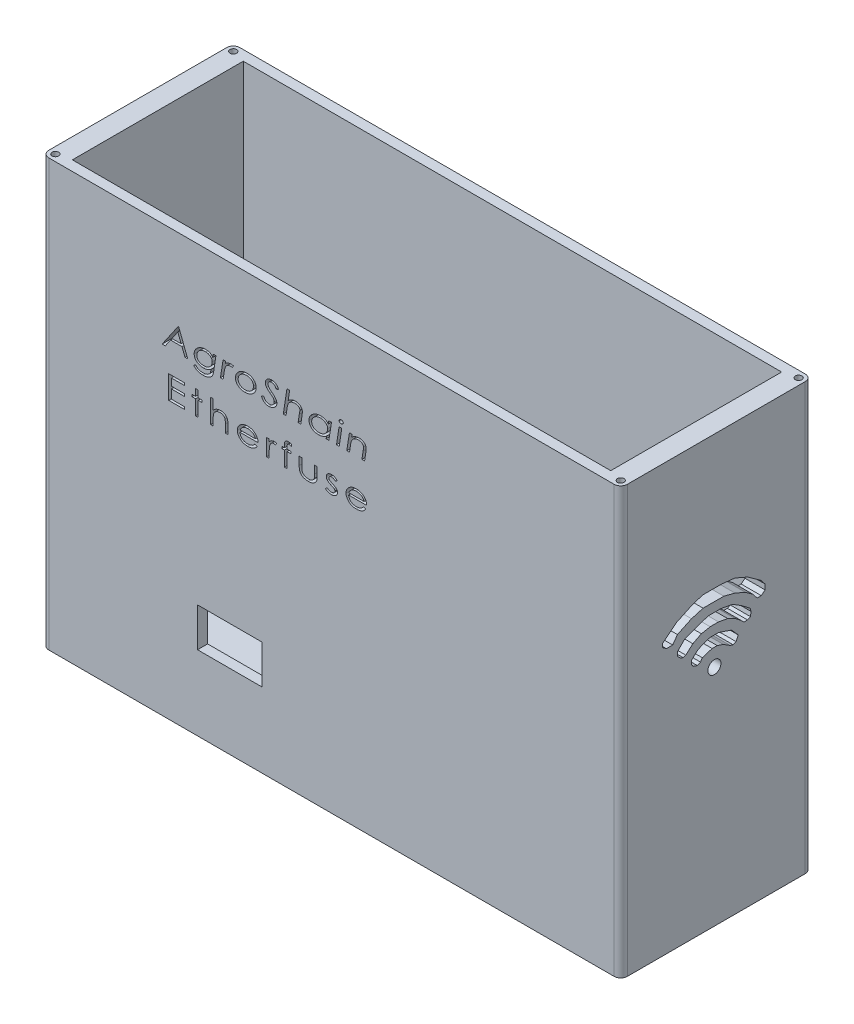
from build123d import *

# Parameters (mm, degrees)
CROQUIS1_W                  = 87.688847678
CROQUIS1_H                  = 28.96
CROQUIS1_W_2                = 81.6
CROQUIS1_H_2                = 25.9
SALIENTE_EXTRUIR1_DEPTH     = 72.4
CROQUIS2_W                  = 81.6
CROQUIS2_H                  = 33.9
SALIENTE_EXTRUIR2_DEPTH     = 2.4
CROQUIS3_W                  = 33.4
CROQUIS3_H                  = 2.5
CORTAR_EXTRUIR4_DEPTH       = 115.951678922
CROQUIS8_W                  = 81.6
CROQUIS8_H                  = 6.47
CORTAR_EXTRUIR10_DEPTH      = 10
CORTAR_EXTRUIR13_DEPTH      = 115.712001931
CORTAR_EXTRUIR13_DEPTH_BACK = 115.712001931
CROQUIS14_W                 = 88.03016231
CROQUIS14_H                 = 8.033828849
CROQUIS15_W                 = 9.8
CROQUIS15_H                 = 5.890341811
CORTAR_EXTRUIR18_DEPTH      = 10
REDONDEO1_R                 = 1
CROQUIS17_R                 = 0.5
CORTAR_EXTRUIR19_DEPTH      = 10
CROQUIS18_R                 = 0.990463245
CORTAR_EXTRUIR20_DEPTH      = 10
CORTAR_EXTRUIR21_DEPTH      = 10


with BuildPart() as part:
    # Croquis1 → Saliente-Extruir1 (new body)
    with BuildSketch(Plane(origin=(0, 0, 0), x_dir=(1, 0, 0), z_dir=(0, 1, 0))):
        with Locations((40.8, -12.95)):
            Rectangle(CROQUIS1_W, CROQUIS1_H)
        with Locations((40.8, -12.95)):
            Rectangle(CROQUIS1_W_2, CROQUIS1_H_2, mode=Mode.SUBTRACT)
    extrude(amount=SALIENTE_EXTRUIR1_DEPTH)

    # Croquis2 → Saliente-Extruir2 (add)
    with BuildSketch(Plane(origin=(0, 0, 0), x_dir=(1, 0, 0), z_dir=(0, 1, 0))):
        with Locations((40.8, -16.95)):
            Rectangle(CROQUIS2_W, CROQUIS2_H)
    extrude(amount=SALIENTE_EXTRUIR2_DEPTH)

    # Croquis3 → Cortar-Extruir4 (cut, through all)
    with BuildSketch(Plane(origin=(0, 2.4, 0), x_dir=(1, 0, 0), z_dir=(0, 1, 0))):
        with Locations((16.7, -1.25)):
            Rectangle(CROQUIS3_W, CROQUIS3_H)
        with Locations((16.7, -24.65)):
            Rectangle(CROQUIS3_W, CROQUIS3_H)
    extrude(amount=-CORTAR_EXTRUIR4_DEPTH, mode=Mode.SUBTRACT)

    # Croquis8 → Cortar-Extruir10 (cut)
    with BuildSketch(Plane(origin=(0, 2.4, 0), x_dir=(1, 0, 0), z_dir=(0, 1, 0))):
        with Locations((40.8, -30.665)):
            Rectangle(CROQUIS8_W, CROQUIS8_H)
    extrude(amount=-CORTAR_EXTRUIR10_DEPTH, mode=Mode.SUBTRACT)

    # Croquis14 → Cortar-Extruir13 (cut, two sides: drawn at the far end of the back side and taken through both)
    with BuildSketch(Plane.XY.offset(-CORTAR_EXTRUIR13_DEPTH_BACK)):
        with Locations((40.711598369, 68.616914425)):
            Rectangle(CROQUIS14_W, CROQUIS14_H)
    extrude(amount=CORTAR_EXTRUIR13_DEPTH + CORTAR_EXTRUIR13_DEPTH_BACK, mode=Mode.SUBTRACT)

    # Croquis15 → Cortar-Extruir18 (cut)
    with BuildSketch(Plane(origin=(0, 0, 25.9), x_dir=(-1, 0, 0), z_dir=(0, 0, -1))):
        with Locations((-25.4, 14.254829095)):
            Rectangle(CROQUIS15_W, CROQUIS15_H)
    extrude(amount=-CORTAR_EXTRUIR18_DEPTH, mode=Mode.SUBTRACT)

    # Redondeo1
    redondeo1_edges = [part.edges().sort_by_distance(p)[0] for p in [
        (-3.044423839, 32.3, 27.43),
        (-3.044423839, 32.3, -1.53),
        (84.644423839, 32.3, -1.53),
        (84.644423839, 32.3, 27.43),
    ]]
    fillet(redondeo1_edges, radius=REDONDEO1_R)

    # Croquis17 → Cortar-Extruir19 (cut)
    with BuildSketch(Plane(origin=(0, 64.6, 0), x_dir=(1, 0, 0), z_dir=(0, 1, 0))):
        with Locations(Location((-2.044423839, -26.43, 0), (0, 0, 270))):
            Circle(CROQUIS17_R)
        with Locations(Location((-2.044423839, 0.53, 0), (0, 0, 270))):
            Circle(CROQUIS17_R)
        with Locations(Location((83.644423839, -26.43, 0), (0, 0, 270))):
            Circle(CROQUIS17_R)
        with Locations(Location((83.644423839, 0.53, 0), (0, 0, 270))):
            Circle(CROQUIS17_R)
    extrude(amount=-CORTAR_EXTRUIR19_DEPTH, mode=Mode.SUBTRACT)

    # Croquis18 → Cortar-Extruir20 (cut)
    with BuildSketch(Plane(origin=(84.644423839, 0, 0), x_dir=(0, 0, -1), z_dir=(1, 0, 0))):
        with Locations((-13.23534673, 34.005364937)):
            Circle(CROQUIS18_R)
        Polygon((-21.065321409, 41.077628174), (-19.037269912, 42.700069372), (-16.456113462, 43.91690027), (-14.944293255, 44.359384233), (-13.506220376, 44.359384233), (-12.068147496, 44.359384233), (-10.113843327, 44.138142251), (-8.196412821, 43.308484821), (-6.205234988, 41.888848773), (-5.556258509, 41.077628174), (-5.556258509, 40.303281239), (-6.136344192, 39.839212693), (-6.758339941, 39.839212693), (-7.439333553, 40.690454707), (-8.551290005, 41.483238474), (-10.113843327, 42.159343276), (-11.810031851, 42.598666797), (-13.100610076, 42.598666797), (-14.944293255, 42.598666797), (-16.702146668, 42.084173115), (-18.837241997, 41.077628174), (-19.556654534, 40.068582018), (-20.512216455, 40.068582018), (-21.065321409, 40.462925364), align=None)
        Polygon((-15.346562253, 35.72045671), (-15.807873901, 35.489800885), (-16.365518277, 35.675682344), (-16.702146668, 36.004133621), (-16.702146668, 36.615944028), (-16.292531936, 37.035756516), (-15.807873901, 37.470727376), (-14.944293255, 37.9025177), (-14.225809975, 38.12199088), (-13.873683153, 38.229554126), (-12.605828341, 38.229554126), (-11.63736808, 37.906734039), (-10.656402427, 37.579745488), (-10.113843327, 36.975209296), (-9.618138816, 36.422879942), (-9.960070356, 35.72045671), (-10.385122877, 35.507930449), (-10.851920088, 35.66352952), (-11.506821178, 36.071668326), (-11.889311392, 36.310038824), (-12.605828341, 36.548877807), (-12.807027001, 36.615944028), (-13.573269899, 36.615944028), (-14.46781659, 36.342689224), (-15.068360518, 36.159242664), align=None)
        Polygon((-17.566668351, 37.743224959), (-17.970579342, 37.61984334), (-18.362182144, 37.750377608), (-18.83723443, 38.213890294), (-18.83723443, 38.820567834), (-17.768623847, 39.915782517), (-16.292524369, 40.462910559), (-15.207453818, 40.865100611), (-14.130161797, 41.194178146), (-12.247562299, 41.194178146), (-10.48126425, 40.865100611), (-9.068286576, 39.98452333), (-7.822079961, 39.031999329), (-7.664834455, 38.517229064), (-7.778578038, 37.906719234), (-8.211087496, 37.685658668), (-8.766675071, 37.685658668), (-9.306093688, 38.211974149), (-10.113843327, 38.829368495), (-11.220703284, 39.368175176), (-12.605828341, 39.626236684), (-13.873683153, 39.626236684), (-15.207453818, 39.368175176), (-16.497339302, 38.708899847), align=None)
    extrude(amount=-CORTAR_EXTRUIR20_DEPTH, mode=Mode.SUBTRACT)

    # Croquis20 → Cortar-Extruir21 (cut)
    # profile 1 of 19: a face of its own
    with BuildSketch(Plane.XY.offset(27.43)):
        Polygon((17.641608202, 52.250097026), (19.021415895, 48.750097026), (18.595834965, 48.750097026), (18.13660019, 49.916763692), (16.409737209, 49.916763692), (15.606952754, 48.750097026), (15.140005638, 48.750097026), (17.546255638, 52.250097026), align=None)
        Polygon((17.506992818, 51.513218019), (16.625682722, 50.230866256), (18.012501632, 50.230866256), align=None, mode=Mode.SUBTRACT)
    # profile 2 of 19: a face of its own
    with BuildSketch(Plane.XY.offset(27.43)):
        with BuildLine():
            Line((22.887541696, 51.307789333), (23.294192337, 51.307789333))
            Line((23.294192337, 51.307789333), (22.959056119, 49.145529718))
            add(Edge.make_bspline(
                [(22.959056119, 49.145529718), (22.952018922, 49.103657793), (22.938508999, 49.023272588), (22.915696975, 48.907873434), (22.893444342, 48.802104851), (22.867669653, 48.706465662), (22.842094584, 48.620287333), (22.815621184, 48.543630217), (22.788154125, 48.476526409), (22.766567704, 48.43654047), (22.75643192, 48.417765295)],
                knots=[0, 0, 0, 0, 1.342924034, 2.578128984, 3.72071628, 4.760699082, 5.710203448, 6.563529344, 7.325513227, 8, 8, 8, 8], degree=3))
            add(Edge.make_bspline(
                [(22.75643192, 48.417765295), (22.742177988, 48.394076352), (22.713475033, 48.346374239), (22.661345769, 48.279983872), (22.604025326, 48.215696911), (22.538867676, 48.155423491), (22.467387669, 48.097722657), (22.388433089, 48.044072233), (22.303478161, 47.992606577), (22.21199334, 47.945083541), (22.114782757, 47.902911437), (22.013558294, 47.864393161), (21.907579213, 47.83303684), (21.796918203, 47.808070348), (21.682300023, 47.787728401), (21.563216717, 47.77285105), (21.439846895, 47.764524106), (21.356070169, 47.763458644), (21.313523267, 47.762917539)],
                knots=[0, 0, 0, 0, 0.800730517, 1.612420512, 2.442312786, 3.295521561, 4.182181423, 5.102996533, 6.060395058, 7.060354773, 8.088758893, 9.130686768, 10.198160255, 11.289426092, 12.417749155, 13.571515046, 14.766668074, 16, 16, 16, 16], degree=3))
            add(Edge.make_bspline(
                [(21.313523267, 47.762917539), (21.271679555, 47.763505725), (21.189556392, 47.764660111), (21.068789088, 47.77225909), (20.953014195, 47.785734007), (20.841751136, 47.803664504), (20.735335163, 47.827677044), (20.633288126, 47.856047779), (20.536346366, 47.890880051), (20.443625557, 47.929487788), (20.356755093, 47.974994947), (20.274427392, 48.023480963), (20.198263582, 48.078044542), (20.127527485, 48.137118172), (20.061112704, 48.19987636), (20.001516834, 48.268695478), (19.946437983, 48.341277949), (19.914601303, 48.393178825), (19.898659484, 48.419167539)],
                knots=[0, 0, 0, 0, 1.227771067, 2.409643859, 3.548582486, 4.64661441, 5.714688438, 6.747988066, 7.752185209, 8.735443261, 9.692331544, 10.627272038, 11.536820634, 12.437641849, 13.330045583, 14.214456928, 15.105911689, 16, 16, 16, 16], degree=3))
            Line((19.898659484, 48.419167539), (20.249220382, 48.525738051))
            add(Edge.make_bspline(
                [(20.249220382, 48.525738051), (20.276472221, 48.489784217), (20.330739711, 48.418188153), (20.43085742, 48.326451811), (20.544010787, 48.248815905), (20.670807344, 48.185521148), (20.810780542, 48.136502074), (20.963910453, 48.101927347), (21.130399577, 48.080638148), (21.245914653, 48.078255527), (21.305810927, 48.077020103)],
                knots=[0, 0, 0, 0, 0.90421747, 1.800598237, 2.711594872, 3.651621576, 4.636959247, 5.681772741, 6.797964897, 8, 8, 8, 8], degree=3))
            add(Edge.make_bspline(
                [(21.305810927, 48.077020103), (21.338073225, 48.077409131), (21.401492645, 48.07817386), (21.494851294, 48.084638138), (21.584722485, 48.095021277), (21.671312588, 48.10980191), (21.754677138, 48.12860547), (21.834776005, 48.151709283), (21.911542055, 48.179201956), (21.984849006, 48.210542444), (22.053818203, 48.245409605), (22.117907332, 48.282727919), (22.177185531, 48.321934759), (22.231384376, 48.364069726), (22.280207992, 48.408791074), (22.324277633, 48.455454247), (22.363270585, 48.504578836), (22.385160759, 48.539772791), (22.396055318, 48.557288532)],
                knots=[0, 0, 0, 0, 1.245556966, 2.448446164, 3.611376377, 4.737344817, 5.838451149, 6.909379305, 7.954019465, 8.984849745, 9.985660861, 10.935932317, 11.84691814, 12.727775474, 13.58364317, 14.400768809, 15.2040758, 16, 16, 16, 16], degree=3))
            add(Edge.make_bspline(
                [(22.396055318, 48.557288532), (22.402307721, 48.569357552), (22.416229043, 48.596229891), (22.434794972, 48.642413526), (22.452514409, 48.698190464), (22.471589295, 48.762614388), (22.490463237, 48.836527673), (22.508934212, 48.919898515), (22.529103983, 49.012492793), (22.540714126, 49.077709712), (22.546796504, 49.111875872)],
                knots=[0, 0, 0, 0, 0.565577796, 1.259290232, 2.068372883, 3.001117242, 4.055812139, 5.242895862, 6.555594768, 8, 8, 8, 8], degree=3))
            Line((22.546796504, 49.111875872), (22.553807722, 49.156747667))
            add(Edge.make_bspline(
                [(22.553807722, 49.156747667), (22.516130535, 49.124136769), (22.440980907, 49.059092188), (22.316605864, 48.976325541), (22.183802424, 48.906851238), (22.043004338, 48.848630422), (21.892826949, 48.805135175), (21.734657661, 48.772593004), (21.567793926, 48.753586998), (21.453795869, 48.751277131), (21.395554517, 48.750097026)],
                knots=[0, 0, 0, 0, 0.95057563, 1.895985621, 2.84397145, 3.808393263, 4.799425513, 5.824065256, 6.88831981, 8, 8, 8, 8], degree=3))
            add(Edge.make_bspline(
                [(21.395554517, 48.750097026), (21.3438576, 48.750891975), (21.24302537, 48.752442484), (21.095749657, 48.768814455), (20.956044302, 48.792422239), (20.823932258, 48.827732566), (20.699927284, 48.873317369), (20.583009026, 48.92818857), (20.4742095, 48.993433418), (20.373908532, 49.068401637), (20.283845472, 49.151496525), (20.204506854, 49.240959777), (20.137426833, 49.336583164), (20.083181542, 49.438742204), (20.039847522, 49.546442815), (20.009900212, 49.660680681), (19.992225059, 49.780660513), (19.989692501, 49.86248393), (19.988403074, 49.9041435)],
                knots=[0, 0, 0, 0, 1.214179169, 2.368195291, 3.47773072, 4.540670866, 5.576091923, 6.57828998, 7.570889158, 8.551630506, 9.515375682, 10.44521804, 11.356189695, 12.252882227, 13.157359494, 14.077749339, 15.021305408, 16, 16, 16, 16], degree=3))
            add(Edge.make_bspline(
                [(19.988403074, 49.9041435), (19.988989813, 49.935499075), (19.990154015, 49.997714552), (20.002193922, 50.090243824), (20.019953211, 50.181587003), (20.046410398, 50.271113818), (20.078504506, 50.359831875), (20.119374331, 50.446362146), (20.167582495, 50.531606744), (20.221832256, 50.615611966), (20.283291958, 50.696205999), (20.35034542, 50.773439184), (20.423527736, 50.845897046), (20.501017572, 50.915801453), (20.58520531, 50.980175815), (20.674162229, 51.041365113), (20.769045818, 51.098171299), (20.868733716, 51.150160001), (20.971090741, 51.197735666), (21.074828253, 51.239040375), (21.178934826, 51.274262336), (21.283462935, 51.303388183), (21.388790363, 51.324574997), (21.493971713, 51.341285381), (21.599659107, 51.350252199), (21.670146061, 51.351857229), (21.70545035, 51.352661128)],
                knots=[0, 0, 0, 0, 0.911222598, 1.808040434, 2.7089425, 3.614369492, 4.519490425, 5.449746155, 6.39294241, 7.365521537, 8.354952487, 9.337498808, 10.336959914, 11.347677343, 12.369820805, 13.415921302, 14.48576611, 15.583056035, 16.683686527, 17.766381561, 18.827950174, 19.878103973, 20.918960382, 21.950189342, 22.973326228, 24, 24, 24, 24], degree=3))
            add(Edge.make_bspline(
                [(21.70545035, 51.352661128), (21.763261406, 51.351261811), (21.876791105, 51.348513824), (22.042966243, 51.324443912), (22.201810208, 51.287199191), (22.327700908, 51.241823929), (22.42323966, 51.198112811), (22.491077806, 51.161104155), (22.553992798, 51.118205214), (22.615114571, 51.073260373), (22.670600525, 51.021682072), (22.723137204, 50.966683129), (22.771571176, 50.907044346), (22.800663338, 50.864425842), (22.815326151, 50.842945583)],
                knots=[0, 0, 0, 0, 1.631220448, 3.203400473, 4.730012566, 6.23051156, 6.971471378, 7.694953829, 8.408592524, 9.119817844, 9.834340415, 10.543696626, 11.26600491, 12, 12, 12, 12], degree=3))
            Line((22.815326151, 50.842945583), (22.887541696, 51.307789333))
        make_face()
        with BuildLine():
            add(Edge.make_bspline(
                [(21.748218779, 51.038558564), (21.687351591, 51.036603003), (21.567299598, 51.032745934), (21.390503759, 51.004154921), (21.22059364, 50.956055032), (21.084891285, 50.900957736), (20.9822719, 50.847379085), (20.909074778, 50.804956444), (20.840816359, 50.758362859), (20.776863238, 50.708510086), (20.717105834, 50.655354703), (20.662275502, 50.598184842), (20.611828098, 50.538046266), (20.566090997, 50.474802533), (20.525554262, 50.408833481), (20.4895238, 50.340855633), (20.459496174, 50.270676407), (20.434587783, 50.198579756), (20.415802192, 50.124429848), (20.402673399, 50.048227894), (20.393770723, 49.97025834), (20.39276001, 49.917489752), (20.392249228, 49.890822186)],
                knots=[0, 0, 0, 0, 1.844671105, 3.638355064, 5.412413805, 7.188508411, 8.066230348, 8.920419997, 9.751619008, 10.569333367, 11.377136045, 12.173802125, 12.968417987, 13.754939079, 14.537461563, 15.313866723, 16.085050277, 16.849041017, 17.623990265, 18.400880123, 19.191855658, 20, 20, 20, 20], degree=3))
            add(Edge.make_bspline(
                [(20.392249228, 49.890822186), (20.392929641, 49.860611481), (20.394265805, 49.801285052), (20.408566615, 49.714769256), (20.42862347, 49.631980678), (20.46028389, 49.554759982), (20.49908566, 49.481403815), (20.546912841, 49.412715233), (20.603421234, 49.34858081), (20.668132354, 49.289649302), (20.740137142, 49.236752363), (20.818146838, 49.190069477), (20.902573322, 49.151692611), (20.992403096, 49.118941038), (21.088692948, 49.095247053), (21.190209742, 49.076461487), (21.297884747, 49.066157057), (21.371696193, 49.064863471), (21.409576952, 49.06419959)],
                knots=[0, 0, 0, 0, 0.982777849, 1.929935134, 2.849133316, 3.750741977, 4.639345518, 5.547099836, 6.469191751, 7.417265787, 8.391401842, 9.374179691, 10.371842536, 11.406942418, 12.483026579, 13.596615784, 14.766559611, 16, 16, 16, 16], degree=3))
            add(Edge.make_bspline(
                [(21.409576952, 49.06419959), (21.455665845, 49.065030908), (21.546010245, 49.066660474), (21.678219682, 49.082718117), (21.804561581, 49.107530007), (21.9248147, 49.143664256), (22.03965818, 49.188956959), (22.147969616, 49.24546922), (22.250407107, 49.311791651), (22.345729055, 49.387657479), (22.432257645, 49.471363148), (22.508636639, 49.560840394), (22.573864188, 49.655619428), (22.625688742, 49.75677864), (22.666665352, 49.862516767), (22.69626897, 49.973404974), (22.714249639, 50.089817441), (22.716183998, 50.16933637), (22.7171691, 50.209832603)],
                knots=[0, 0, 0, 0, 1.138052098, 2.230833273, 3.284941443, 4.315142737, 5.328248941, 6.33014015, 7.327780706, 8.338515372, 9.334735013, 10.297210408, 11.240376269, 12.169944568, 13.098418613, 14.036695002, 15.00015685, 16, 16, 16, 16], degree=3))
            add(Edge.make_bspline(
                [(22.7171691, 50.209832603), (22.716214121, 50.242833767), (22.714356028, 50.307043811), (22.700307742, 50.400279252), (22.6763906, 50.487085728), (22.64326733, 50.568021462), (22.600299285, 50.642902281), (22.547179543, 50.711273466), (22.484788353, 50.773437865), (22.414128573, 50.828811982), (22.338236801, 50.877928499), (22.259586885, 50.921100849), (22.178542706, 50.956437749), (22.096439914, 50.987220531), (22.011953934, 51.010375062), (21.925602564, 51.026209803), (21.837505723, 51.036457844), (21.778161553, 51.037854078), (21.748218779, 51.038558564)],
                knots=[0, 0, 0, 0, 1.109775648, 2.159279721, 3.162451769, 4.131788687, 5.093187958, 6.057058737, 7.035374861, 8.048233103, 9.070836866, 10.073392716, 11.062326292, 12.042220295, 13.020568002, 14.004238589, 14.993015933, 16, 16, 16, 16], degree=3))
        make_face(mode=Mode.SUBTRACT)
    # profile 3 of 19: a face of its own
    with BuildSketch(Plane.XY.offset(27.43)):
        with BuildLine():
            Line((24.369152273, 51.307789333), (24.776504036, 51.307789333))
            Line((24.776504036, 51.307789333), (24.728827754, 51.001399109))
            add(Edge.make_bspline(
                [(24.728827754, 51.001399109), (24.756774537, 51.028228186), (24.812835216, 51.082046768), (24.907538815, 51.1512067), (25.010310254, 51.211305583), (25.120227452, 51.261933815), (25.23500216, 51.302439775), (25.352427442, 51.331207555), (25.470966431, 51.349585863), (25.55071051, 51.351637345), (25.59050644, 51.352661128)],
                knots=[0, 0, 0, 0, 0.97330033, 1.952420648, 2.940197913, 3.963069094, 4.990925483, 5.995810114, 6.999817919, 8, 8, 8, 8], degree=3))
            add(Edge.make_bspline(
                [(25.59050644, 51.352661128), (25.61930263, 51.351848849), (25.677861453, 51.350197031), (25.766386586, 51.336489541), (25.857244058, 51.316971585), (25.916938486, 51.296495549), (25.947377433, 51.286054558)],
                knots=[0, 0, 0, 0, 0.946890739, 1.925560497, 2.942216945, 4, 4, 4, 4], degree=3))
            Line((25.947377433, 51.286054558), (25.762281279, 50.988778917))
            add(Edge.make_bspline(
                [(25.762281279, 50.988778917), (25.73829894, 50.996356055), (25.693009146, 51.010665212), (25.626924046, 51.0260333), (25.567264584, 51.036932326), (25.529081541, 51.038041459), (25.511279677, 51.038558564)],
                knots=[0, 0, 0, 0, 1.174381522, 2.217777741, 3.169084603, 4, 4, 4, 4], degree=3))
            add(Edge.make_bspline(
                [(25.511279677, 51.038558564), (25.476106471, 51.037267292), (25.405325416, 51.034668791), (25.299860936, 51.011398408), (25.194738166, 50.975652739), (25.091835692, 50.925250957), (24.993422775, 50.86210161), (24.904409104, 50.783738854), (24.824535065, 50.692832038), (24.767390652, 50.605534423), (24.725160641, 50.526976811), (24.696454806, 50.456834022), (24.667447234, 50.37799293), (24.641411239, 50.288983392), (24.61507472, 50.190988689), (24.591749743, 50.08276985), (24.569259891, 49.965187177), (24.556133997, 49.883381692), (24.549340574, 49.841042539)],
                knots=[0, 0, 0, 0, 0.993786831, 1.99985416, 3.040930003, 4.128926478, 5.232733597, 6.33841964, 7.472089315, 8.645498373, 9.281282797, 9.992188235, 10.786832843, 11.656820241, 12.614075757, 13.656619706, 14.787162757, 16, 16, 16, 16], degree=3))
            Line((24.549340574, 49.841042539), (24.380370222, 48.750097026))
            Line((24.380370222, 48.750097026), (23.973018459, 48.750097026))
            Line((23.973018459, 48.750097026), (24.369152273, 51.307789333))
        make_face()
    # profile 4 of 19: a face of its own
    with BuildSketch(Plane.XY.offset(27.43)):
        with BuildLine():
            add(Edge.make_bspline(
                [(27.994793299, 51.352661128), (28.026830716, 51.35239744), (28.090301871, 51.351875032), (28.184315085, 51.343441419), (28.276359123, 51.331950609), (28.366441067, 51.314877282), (28.454568638, 51.293490625), (28.540445434, 51.266243012), (28.624903085, 51.235975264), (28.70618708, 51.199180825), (28.785000171, 51.159679208), (28.859200379, 51.115199017), (28.929693052, 51.067845784), (28.994910861, 51.015560001), (29.056039921, 50.960086363), (29.11324373, 50.90126121), (29.16499431, 50.837790493), (29.212576509, 50.771325232), (29.255778933, 50.702149416), (29.291752961, 50.629435262), (29.323931147, 50.555332611), (29.348663271, 50.478347988), (29.369678296, 50.399656941), (29.383193057, 50.318176992), (29.391982724, 50.234566359), (29.3930116, 50.178071389), (29.393531279, 50.149536128)],
                knots=[0, 0, 0, 0, 1.118560716, 2.216044405, 3.294327039, 4.357362665, 5.416536518, 6.459577545, 7.502874062, 8.547989143, 9.573799816, 10.580333023, 11.567448553, 12.537576741, 13.496826579, 14.449349892, 15.400438128, 16.354080002, 17.303274825, 18.245105566, 19.185095132, 20.12210285, 21.066476983, 22.027323086, 23.003613053, 24, 24, 24, 24], degree=3))
            add(Edge.make_bspline(
                [(29.393531279, 50.149536128), (29.392935393, 50.116782003), (29.391752801, 50.051778339), (29.379873112, 49.955250373), (29.361763545, 49.860331861), (29.336444628, 49.767057446), (29.304312494, 49.675453785), (29.263766148, 49.586234977), (29.217011985, 49.498285868), (29.162265796, 49.413373922), (29.101987118, 49.331519962), (29.037192806, 49.253250123), (28.96563721, 49.181415199), (28.89075161, 49.112666359), (28.809943874, 49.049970904), (28.724556249, 48.991349875), (28.634386278, 48.93727758), (28.538730598, 48.889265874), (28.439703044, 48.845609923), (28.33663176, 48.808747406), (28.231069172, 48.776112559), (28.121840466, 48.750453324), (28.009574912, 48.729744549), (27.893829878, 48.716472045), (27.77504664, 48.706516179), (27.694735249, 48.705659327), (27.654048106, 48.705225231)],
                knots=[0, 0, 0, 0, 0.936257208, 1.858091106, 2.776915956, 3.697780267, 4.619396097, 5.549742788, 6.497592679, 7.465355303, 8.435814196, 9.403622973, 10.367732516, 11.332953317, 12.308919706, 13.289565921, 14.293617725, 15.312835966, 16.348379432, 17.386443127, 18.44140853, 19.506423958, 20.593173033, 21.703987392, 22.836800209, 24, 24, 24, 24], degree=3))
            add(Edge.make_bspline(
                [(27.654048106, 48.705225231), (27.604219921, 48.706003498), (27.506392525, 48.707531467), (27.36321481, 48.724379995), (27.226768723, 48.750073269), (27.096739622, 48.785561584), (26.973991258, 48.832907097), (26.857512343, 48.88961666), (26.748278036, 48.95755729), (26.646372783, 49.034741038), (26.55447037, 49.120426966), (26.47349703, 49.212214297), (26.40507134, 49.309950973), (26.349425206, 49.413865569), (26.305494959, 49.52310563), (26.274724898, 49.638205594), (26.256145066, 49.758873245), (26.253733073, 49.841209756), (26.252505638, 49.883109846)],
                knots=[0, 0, 0, 0, 1.16717745, 2.291512927, 3.373153642, 4.41886867, 5.445141988, 6.451821602, 7.450348862, 8.45480624, 9.442946045, 10.389901233, 11.318206252, 12.232183711, 13.146472887, 14.071135734, 15.018423451, 16, 16, 16, 16], degree=3))
            add(Edge.make_bspline(
                [(26.252505638, 49.883109846), (26.253074026, 49.916336544), (26.25420212, 49.982282455), (26.266481839, 50.080083467), (26.283015038, 50.176511481), (26.309874217, 50.270357776), (26.341676773, 50.362788562), (26.382039418, 50.452611422), (26.429372709, 50.540537381), (26.482876139, 50.626705498), (26.544103341, 50.7088252), (26.609793733, 50.787788532), (26.68155192, 50.861321848), (26.758404772, 50.930363819), (26.840412116, 50.995074677), (26.928431264, 51.054376141), (27.021042427, 51.110202598), (27.119182841, 51.160271421), (27.220714971, 51.205535936), (27.325008249, 51.245246641), (27.431517725, 51.277709505), (27.539935824, 51.305622375), (27.650793691, 51.326255227), (27.763534517, 51.341815484), (27.878478673, 51.351238785), (27.955746692, 51.35218365), (27.994793299, 51.352661128)],
                knots=[0, 0, 0, 0, 0.94380979, 1.873204389, 2.798244936, 3.721638461, 4.643884498, 5.574607413, 6.516662495, 7.480570606, 8.454383662, 9.425633422, 10.397995529, 11.371627335, 12.360279104, 13.364363403, 14.386197354, 15.431910996, 16.493474606, 17.54457509, 18.601389882, 19.656616985, 20.724871949, 21.804241494, 22.890395812, 24, 24, 24, 24], degree=3))
        make_face()
        with BuildLine():
            add(Edge.make_bspline(
                [(27.979368619, 51.038558564), (27.920594057, 51.036898607), (27.804229667, 51.033612151), (27.632720651, 51.004545642), (27.466767519, 50.957367084), (27.33412441, 50.902720339), (27.232050863, 50.852083383), (27.160745675, 50.808710797), (27.092795002, 50.763631974), (27.030655764, 50.713347283), (26.972081982, 50.660744709), (26.917710479, 50.604667498), (26.868951738, 50.54427241), (26.824533888, 50.48109794), (26.785571358, 50.415263215), (26.750907011, 50.347691471), (26.721457633, 50.278392834), (26.697346714, 50.207183305), (26.679426639, 50.134154956), (26.66584747, 50.059740118), (26.658115595, 49.983533785), (26.656944195, 49.932204963), (26.656351792, 49.906246865)],
                knots=[0, 0, 0, 0, 1.815744619, 3.594888821, 5.360265598, 7.139175103, 8.021198054, 8.879803335, 9.717361772, 10.539860691, 11.348020787, 12.150184946, 12.951274843, 13.744935717, 14.535400783, 15.314058016, 16.090970582, 16.860864946, 17.635321636, 18.413308306, 19.19757563, 20, 20, 20, 20], degree=3))
            add(Edge.make_bspline(
                [(26.656351792, 49.906246865), (26.656992124, 49.874167023), (26.658251246, 49.811086576), (26.673143626, 49.719107631), (26.694891278, 49.631310229), (26.7279218, 49.548860602), (26.768664642, 49.470410232), (26.818621603, 49.396199443), (26.878802509, 49.327665427), (26.946646633, 49.263677994), (27.022338905, 49.206874896), (27.102874122, 49.155928156), (27.189401019, 49.113471675), (27.281463099, 49.079642774), (27.378340184, 49.051732036), (27.480806847, 49.033517418), (27.588289423, 49.020802002), (27.661954251, 49.019826563), (27.699621023, 49.019327795)],
                knots=[0, 0, 0, 0, 1.001337566, 1.968987925, 2.90410452, 3.822101158, 4.736606195, 5.662151584, 6.609419866, 7.580617816, 8.570790835, 9.561529105, 10.554283505, 11.575576769, 12.622725082, 13.699719377, 14.823805763, 16, 16, 16, 16], degree=3))
            add(Edge.make_bspline(
                [(27.699621023, 49.019327795), (27.758385728, 49.021053778), (27.873501785, 49.024434862), (28.041987676, 49.051778492), (28.201797657, 49.096494489), (28.327921911, 49.148992746), (28.423264921, 49.199037429), (28.490598023, 49.24153832), (28.554744923, 49.286843233), (28.614543703, 49.337013441), (28.670550664, 49.391089006), (28.723454394, 49.448750339), (28.772460564, 49.510341009), (28.817165167, 49.575625948), (28.857841393, 49.643101026), (28.89274189, 49.712899502), (28.923436518, 49.783523266), (28.946842872, 49.856047927), (28.965949872, 49.929292248), (28.980356415, 50.003688428), (28.987827426, 50.079502454), (28.989064917, 50.130358215), (28.989685126, 50.155846224)],
                knots=[0, 0, 0, 0, 1.838739738, 3.601965958, 5.327405853, 7.022995275, 7.867334442, 8.695545592, 9.513678828, 10.323923723, 11.136246723, 11.949228327, 12.771863107, 13.597776947, 14.42459753, 15.235997585, 16.039076728, 16.832602049, 17.618673081, 18.407836016, 19.20203553, 20, 20, 20, 20], degree=3))
            add(Edge.make_bspline(
                [(28.989685126, 50.155846224), (28.988426197, 50.198053565), (28.985962441, 50.280654465), (28.960032609, 50.400409106), (28.920545806, 50.513312157), (28.862959873, 50.617437128), (28.791304206, 50.712221528), (28.7061575, 50.796916123), (28.606885119, 50.869426349), (28.495414711, 50.929536797), (28.375515706, 50.978935774), (28.248179086, 51.012745133), (28.115683625, 51.034763926), (28.025265039, 51.037280933), (27.979368619, 51.038558564)],
                knots=[0, 0, 0, 0, 1.009962747, 1.976524267, 2.922487583, 3.867372688, 4.814975844, 5.76145295, 6.734853492, 7.749912048, 8.789909385, 9.834675962, 10.900882815, 12, 12, 12, 12], degree=3))
        make_face(mode=Mode.SUBTRACT)
    # profile 5 of 19: a face of its own
    with BuildSketch(Plane.XY.offset(27.43)):
        with BuildLine():
            Line((32.794813331, 51.570008885), (32.404989613, 51.487276513))
            add(Edge.make_bspline(
                [(32.404989613, 51.487276513), (32.390309555, 51.527094392), (32.361543329, 51.605119299), (32.298541023, 51.710738379), (32.223885147, 51.804587714), (32.135131388, 51.881848334), (32.040157202, 51.946517193), (31.938378259, 51.991462152), (31.833319914, 52.020610624), (31.761547305, 52.024027055), (31.725602593, 52.025738051)],
                knots=[0, 0, 0, 0, 1.098437379, 2.152436994, 3.17374578, 4.195468084, 5.192259919, 6.141776068, 7.069375849, 8, 8, 8, 8], degree=3))
            add(Edge.make_bspline(
                [(31.725602593, 52.025738051), (31.687139395, 52.024220505), (31.612821318, 52.021288322), (31.506697547, 51.996003648), (31.412331199, 51.952193371), (31.343153579, 51.902945072), (31.295420957, 51.856294526), (31.264286001, 51.818237648), (31.238135806, 51.776964528), (31.216316329, 51.733159597), (31.200153071, 51.685909307), (31.188571884, 51.636336044), (31.180130318, 51.583846338), (31.179666844, 51.547842331), (31.179428715, 51.529343821)],
                knots=[0, 0, 0, 0, 1.666566083, 3.220116685, 4.693864045, 6.15360541, 6.877452541, 7.583411723, 8.280659996, 8.992271, 9.700626841, 10.440543491, 11.198766306, 12, 12, 12, 12], degree=3))
            add(Edge.make_bspline(
                [(31.179428715, 51.529343821), (31.18133934, 51.495467396), (31.185259919, 51.42595338), (31.218210592, 51.32186782), (31.268978663, 51.215866523), (31.315587077, 51.14872551), (31.339985606, 51.113578596)],
                knots=[0, 0, 0, 0, 0.895781322, 1.83813253, 2.868307656, 4, 4, 4, 4], degree=3))
            add(Edge.make_bspline(
                [(31.339985606, 51.113578596), (31.349658688, 51.101306799), (31.370906116, 51.074351158), (31.409039272, 51.033075556), (31.45638866, 50.987812308), (31.5118206, 50.937343723), (31.575814488, 50.881869886), (31.648609343, 50.821612682), (31.730841308, 50.75739592), (31.788662747, 50.713184287), (31.818851792, 50.690101032)],
                knots=[0, 0, 0, 0, 0.585079893, 1.285158435, 2.102243681, 3.037836102, 4.092640197, 5.273878203, 6.576669547, 8, 8, 8, 8], degree=3))
            add(Edge.make_bspline(
                [(31.818851792, 50.690101032), (31.850483471, 50.666138591), (31.911934743, 50.619586444), (32.000292583, 50.549826555), (32.079612806, 50.479585744), (32.15257092, 50.411534947), (32.2173907, 50.344410527), (32.275788763, 50.278923216), (32.325915554, 50.214095501), (32.382290705, 50.130994248), (32.439325137, 50.028306832), (32.488195388, 49.903565107), (32.519627612, 49.780191023), (32.523625554, 49.697718999), (32.525582561, 49.657348628)],
                knots=[0, 0, 0, 0, 1.100387436, 2.137736962, 3.120433273, 4.037294312, 4.903447456, 5.70692268, 6.469091827, 7.173655561, 8.490410933, 9.71545644, 10.881707216, 12, 12, 12, 12], degree=3))
            add(Edge.make_bspline(
                [(32.525582561, 49.657348628), (32.523493183, 49.615101695), (32.519305257, 49.530422413), (32.486976648, 49.404933076), (32.433205261, 49.282796231), (32.360508784, 49.164423034), (32.270514366, 49.053587957), (32.164781504, 48.953498663), (32.044066455, 48.866579509), (31.910848276, 48.792705212), (31.768258354, 48.734431577), (31.620163637, 48.690992475), (31.467324703, 48.665205613), (31.363919168, 48.661976567), (31.311940734, 48.660353436)],
                knots=[0, 0, 0, 0, 0.877158761, 1.758167229, 2.673854505, 3.64165468, 4.635969568, 5.632180106, 6.65795751, 7.718772166, 8.790149715, 9.852119773, 10.920333902, 12, 12, 12, 12], degree=3))
            add(Edge.make_bspline(
                [(31.311940734, 48.660353436), (31.278960391, 48.661045466), (31.214021204, 48.662408091), (31.118466602, 48.672618903), (31.025886774, 48.688168641), (30.937138811, 48.712671801), (30.850994406, 48.741635639), (30.768866115, 48.778478682), (30.689770181, 48.821447097), (30.614309468, 48.870939794), (30.543234523, 48.927268721), (30.477082343, 48.989922902), (30.416179153, 49.058708252), (30.360080061, 49.133450752), (30.310905299, 49.215331891), (30.265057956, 49.302111738), (30.224555249, 49.395279586), (30.20317391, 49.460608029), (30.192249228, 49.49398725)],
                knots=[0, 0, 0, 0, 1.051099559, 2.069643432, 3.060511358, 4.039971, 5.001213331, 5.955065504, 6.90518644, 7.868072932, 8.827957433, 9.792341416, 10.768622645, 11.753507133, 12.766724214, 13.809740209, 14.880898383, 16, 16, 16, 16], degree=3))
            Line((30.192249228, 49.49398725), (30.573659484, 49.602661128))
            add(Edge.make_bspline(
                [(30.573659484, 49.602661128), (30.581737926, 49.576837059), (30.597554141, 49.526277925), (30.626384531, 49.454128153), (30.658532139, 49.38686509), (30.695305436, 49.325384582), (30.734428046, 49.267903038), (30.777917458, 49.216052033), (30.825212427, 49.169448765), (30.875844271, 49.128174519), (30.929042587, 49.091299982), (30.985483165, 49.060998542), (31.043046687, 49.033834626), (31.102913641, 49.012148774), (31.164595076, 48.995280072), (31.228406951, 48.983563919), (31.293961053, 48.975271944), (31.338556962, 48.974729314), (31.36101926, 48.974456)],
                knots=[0, 0, 0, 0, 1.191478996, 2.332713156, 3.419291159, 4.471532603, 5.485251446, 6.479069261, 7.447230608, 8.405490045, 9.353464747, 10.293356144, 11.22372826, 12.155124953, 13.094113909, 14.03698847, 15.011260217, 16, 16, 16, 16], degree=3))
            add(Edge.make_bspline(
                [(31.36101926, 48.974456), (31.386523175, 48.974921484), (31.436998081, 48.975842724), (31.511076323, 48.985354862), (31.582707003, 48.99991544), (31.651188093, 49.020995074), (31.71720233, 49.047832602), (31.780192324, 49.080942597), (31.840945038, 49.119573694), (31.897771777, 49.16419101), (31.950108916, 49.212739131), (31.996284727, 49.264872803), (32.034704698, 49.320385992), (32.066747809, 49.378290418), (32.091439992, 49.439020953), (32.108952164, 49.502542548), (32.119805787, 49.568868427), (32.12108638, 49.614071197), (32.121736408, 49.637016096)],
                knots=[0, 0, 0, 0, 1.090685034, 2.158579332, 3.190134004, 4.214978516, 5.219572931, 6.234860089, 7.255647537, 8.295793417, 9.321661871, 10.306554473, 11.26911217, 12.204431331, 13.132883308, 14.066918718, 15.018769099, 16, 16, 16, 16], degree=3))
            add(Edge.make_bspline(
                [(32.121736408, 49.637016096), (32.120368853, 49.671293268), (32.117617131, 49.740264012), (32.091230998, 49.842179602), (32.051092578, 49.942774581), (32.003807331, 50.024475006), (31.957081461, 50.090749262), (31.913294021, 50.143306378), (31.861679027, 50.197712565), (31.803559659, 50.255632231), (31.736763862, 50.314905309), (31.662178344, 50.376279566), (31.580954596, 50.441349873), (31.522918987, 50.483732521), (31.492830158, 50.505706)],
                knots=[0, 0, 0, 0, 1.104584792, 2.22258816, 3.376959639, 4.593436156, 5.259086811, 5.99321029, 6.799176741, 7.679402306, 8.641111434, 9.680469426, 10.79742868, 12, 12, 12, 12], degree=3))
            add(Edge.make_bspline(
                [(31.492830158, 50.505706), (31.460917331, 50.529376931), (31.399450875, 50.574968887), (31.31307229, 50.643244508), (31.234133233, 50.705545452), (31.165641098, 50.765311932), (31.103921695, 50.818512791), (31.052541965, 50.869360439), (31.008259441, 50.914324932), (30.983843107, 50.944659585), (30.972597786, 50.95863068)],
                knots=[0, 0, 0, 0, 1.379119662, 2.65628608, 3.821887195, 4.868992905, 5.811506755, 6.64909704, 7.377820727, 8, 8, 8, 8], degree=3))
            add(Edge.make_bspline(
                [(30.972597786, 50.95863068), (30.956804639, 50.980352621), (30.925659685, 51.023189485), (30.886092321, 51.09056452), (30.852037679, 51.158451786), (30.823668999, 51.226909751), (30.802707491, 51.297034476), (30.787527179, 51.367605189), (30.776777604, 51.439040432), (30.775982346, 51.487003212), (30.775582561, 51.511114654)],
                knots=[0, 0, 0, 0, 1.079045923, 2.127937863, 3.136286804, 4.130709795, 5.102554312, 6.073672013, 7.03161272, 8, 8, 8, 8], degree=3))
            add(Edge.make_bspline(
                [(30.775582561, 51.511114654), (30.776311338, 51.540380925), (30.777747642, 51.598060094), (30.791524905, 51.682740927), (30.813764341, 51.763447216), (30.845163892, 51.83997755), (30.884499149, 51.913061279), (30.934018441, 51.981598756), (30.991814579, 52.046452447), (31.057885022, 52.106438707), (31.129957885, 52.161405203), (31.207444384, 52.209317625), (31.289462367, 52.249536741), (31.375704605, 52.28219901), (31.465870042, 52.308575544), (31.560512249, 52.326408134), (31.659169161, 52.338093484), (31.726503019, 52.339252629), (31.760658683, 52.339840615)],
                knots=[0, 0, 0, 0, 0.976962499, 1.925437827, 2.85731858, 3.767729803, 4.682981453, 5.623163695, 6.58525977, 7.579872848, 8.599448541, 9.609022705, 10.618023221, 11.645962942, 12.686132226, 13.751741242, 14.859551886, 16, 16, 16, 16], degree=3))
            add(Edge.make_bspline(
                [(31.760658683, 52.339840615), (31.789661116, 52.339355875), (31.84711238, 52.338395646), (31.931996709, 52.329105157), (32.014399726, 52.313464802), (32.094666705, 52.2925655), (32.172582223, 52.265260104), (32.247674002, 52.231362153), (32.320431615, 52.191919981), (32.390268141, 52.146410817), (32.457229236, 52.09527586), (32.519584984, 52.037708075), (32.577396761, 51.974050491), (32.630817433, 51.904896965), (32.678243507, 51.828950196), (32.722662211, 51.748499419), (32.762284936, 51.661851648), (32.78382345, 51.601038421), (32.794813331, 51.570008885)],
                knots=[0, 0, 0, 0, 1.004893049, 1.990604596, 2.954884706, 3.909695274, 4.862648836, 5.81253385, 6.762142555, 7.728189992, 8.698607863, 9.678813064, 10.664990402, 11.675904434, 12.702787015, 13.764875686, 14.859543006, 16, 16, 16, 16], degree=3))
        make_face()
    # profile 6 of 19: a face of its own
    with BuildSketch(Plane.XY.offset(27.43)):
        with BuildLine():
            Line((34.052766055, 52.339840615), (34.459416696, 52.339840615))
            Line((34.459416696, 52.339840615), (34.235758843, 50.873794942))
            add(Edge.make_bspline(
                [(34.235758843, 50.873794942), (34.277460418, 50.911891515), (34.359106273, 50.986479282), (34.489414987, 51.084349724), (34.623213548, 51.166942037), (34.760510338, 51.234664703), (34.901088829, 51.287738836), (35.045205626, 51.324833859), (35.192265785, 51.348126373), (35.291563165, 51.351145164), (35.341427914, 51.352661128)],
                knots=[0, 0, 0, 0, 1.09649907, 2.146791953, 3.159568433, 4.146089688, 5.115590872, 6.072257499, 7.031934208, 8, 8, 8, 8], degree=3))
            add(Edge.make_bspline(
                [(35.341427914, 51.352661128), (35.37908716, 51.35208563), (35.452944737, 51.350956958), (35.56092454, 51.339243028), (35.663752529, 51.321555693), (35.76093327, 51.295189104), (35.853206328, 51.26267043), (35.939764524, 51.221447163), (36.021627221, 51.173998304), (36.096893381, 51.118544715), (36.165485591, 51.058042371), (36.225808523, 50.992499932), (36.276406573, 50.922000857), (36.318369502, 50.847406122), (36.349835969, 50.76776773), (36.373313052, 50.684219009), (36.386519643, 50.595865887), (36.388563979, 50.535661979), (36.389604997, 50.505004878)],
                knots=[0, 0, 0, 0, 1.196544075, 2.346670624, 3.448275519, 4.509596896, 5.543448734, 6.553625042, 7.552457639, 8.546444529, 9.519901095, 10.455816686, 11.371165433, 12.27232799, 13.168947873, 14.086283828, 15.02549532, 16, 16, 16, 16], degree=3))
            add(Edge.make_bspline(
                [(36.389604997, 50.505004878), (36.389511834, 50.48700547), (36.389315722, 50.449116274), (36.386089871, 50.389992684), (36.382120857, 50.325679183), (36.375505719, 50.25676833), (36.367981666, 50.182629952), (36.357917633, 50.103919892), (36.346868614, 50.01995815), (36.338064899, 49.962554797), (36.333515254, 49.932889494)],
                knots=[0, 0, 0, 0, 0.750706853, 1.580256357, 2.469306763, 3.438399768, 4.467606346, 5.577622489, 6.748146921, 8, 8, 8, 8], degree=3))
            Line((36.333515254, 49.932889494), (36.151223587, 48.750097026))
            Line((36.151223587, 48.750097026), (35.743871824, 48.750097026))
            Line((35.743871824, 48.750097026), (35.928266856, 49.93919959))
            add(Edge.make_bspline(
                [(35.928266856, 49.93919959), (35.937056904, 49.995537798), (35.953552758, 50.101264969), (35.978097482, 50.249712023), (36.000683968, 50.377676728), (36.016913664, 50.455957799), (36.024320542, 50.491683564)],
                knots=[0, 0, 0, 0, 1.220007542, 2.28952869, 3.219378375, 4, 4, 4, 4], degree=3))
            add(Edge.make_bspline(
                [(36.024320542, 50.491683564), (36.023935139, 50.511597569), (36.023177437, 50.550748529), (36.012636554, 50.607802135), (35.997434125, 50.662237897), (35.97582038, 50.713932846), (35.946381334, 50.761668911), (35.91189763, 50.807047654), (35.870828048, 50.849262507), (35.823862431, 50.888182312), (35.772222846, 50.923999503), (35.715789694, 50.95489188), (35.655400523, 50.980796157), (35.591230909, 51.001614783), (35.523391835, 51.018829623), (35.451361466, 51.030350268), (35.375465222, 51.037579414), (35.323683298, 51.038227714), (35.297257241, 51.038558564)],
                knots=[0, 0, 0, 0, 0.937076523, 1.84229361, 2.724167336, 3.59754304, 4.471959511, 5.359590011, 6.278568118, 7.240170892, 8.229864637, 9.235301112, 10.266284682, 11.321450654, 12.411162034, 13.560768467, 14.755178084, 16, 16, 16, 16], degree=3))
            add(Edge.make_bspline(
                [(35.297257241, 51.038558564), (35.247154007, 51.037108023), (35.148039143, 51.034238543), (35.001488505, 51.010295001), (34.859288525, 50.970928278), (34.723168507, 50.916424437), (34.596040521, 50.850562582), (34.483179108, 50.770940744), (34.385024703, 50.681192546), (34.315139085, 50.595897293), (34.26734312, 50.518945963), (34.233899581, 50.452277766), (34.203246324, 50.376331903), (34.173830406, 50.291972377), (34.147469412, 50.198209454), (34.123044442, 50.095744219), (34.100593474, 49.984191489), (34.088024857, 49.906527081), (34.081512049, 49.866282923)],
                knots=[0, 0, 0, 0, 1.2747024, 2.521632743, 3.768591465, 5.023471056, 6.24751632, 7.404458138, 8.52851057, 9.623863124, 10.198305501, 10.831471871, 11.519698129, 12.281619523, 13.104456096, 13.997573681, 14.962382365, 16, 16, 16, 16], degree=3))
            Line((34.081512049, 49.866282923), (33.911139452, 48.750097026))
            Line((33.911139452, 48.750097026), (33.50378769, 48.750097026))
            Line((33.50378769, 48.750097026), (34.052766055, 52.339840615))
        make_face()
    # profile 7 of 19: a face of its own
    with BuildSketch(Plane.XY.offset(27.43)):
        with BuildLine():
            Line((40.405069741, 48.750097026), (39.997717978, 48.750097026))
            Line((39.997717978, 48.750097026), (40.057313331, 49.135012891))
            add(Edge.make_bspline(
                [(40.057313331, 49.135012891), (40.013304331, 49.100471652), (39.92615639, 49.032072054), (39.785364448, 48.945763404), (39.640981784, 48.870595917), (39.49061352, 48.810151997), (39.335269632, 48.763143135), (39.174640989, 48.729258492), (39.008694876, 48.709537963), (38.896307229, 48.706673828), (38.839464773, 48.705225231)],
                knots=[0, 0, 0, 0, 1.017960744, 2.015796375, 3.001717968, 3.979273551, 4.962048959, 5.953612182, 6.964995609, 8, 8, 8, 8], degree=3))
            add(Edge.make_bspline(
                [(38.839464773, 48.705225231), (38.787993374, 48.70595252), (38.687353829, 48.707374553), (38.540136334, 48.724810336), (38.399568938, 48.748734938), (38.266413055, 48.786112094), (38.139449539, 48.831725997), (38.020433735, 48.889778015), (37.907568251, 48.956625796), (37.80344552, 49.03388592), (37.708701387, 49.119250223), (37.625530117, 49.211022443), (37.555283003, 49.309328784), (37.498477908, 49.41384444), (37.452894054, 49.523625935), (37.421587928, 49.639817844), (37.402074073, 49.761854156), (37.399812718, 49.84540758), (37.398659484, 49.888017699)],
                knots=[0, 0, 0, 0, 1.18358258, 2.314201928, 3.406925091, 4.460979657, 5.491888529, 6.506798447, 7.502756844, 8.506163032, 9.484591742, 10.432642504, 11.35027071, 12.257488901, 13.164181062, 14.078637051, 15.020153833, 16, 16, 16, 16], degree=3))
            add(Edge.make_bspline(
                [(37.398659484, 49.888017699), (37.400269378, 49.937438595), (37.403448444, 50.0350303), (37.428964487, 50.178305113), (37.469328489, 50.316601775), (37.528745462, 50.448687068), (37.602167012, 50.576591446), (37.694069731, 50.697581123), (37.801313355, 50.813823491), (37.923574936, 50.9232207), (38.057249888, 51.022917534), (38.19723388, 51.112195785), (38.344301251, 51.185542923), (38.496103508, 51.24749941), (38.654637227, 51.293821691), (38.818310216, 51.32887934), (38.988333229, 51.348335895), (39.103507873, 51.351204678), (39.161980799, 51.352661128)],
                knots=[0, 0, 0, 0, 0.934279339, 1.84492634, 2.744290428, 3.652778107, 4.577818532, 5.528273479, 6.520023518, 7.56559639, 8.626569354, 9.671543943, 10.701571862, 11.730992465, 12.768817258, 13.821375907, 14.893936038, 16, 16, 16, 16], degree=3))
            add(Edge.make_bspline(
                [(39.161980799, 51.352661128), (39.224466226, 51.351355886), (39.345715468, 51.348823142), (39.521584879, 51.32421806), (39.685535546, 51.285599097), (39.813635151, 51.239417023), (39.909419172, 51.194482184), (39.977659517, 51.15662095), (40.042439884, 51.113980982), (40.10507135, 51.068110144), (40.163885506, 51.016708127), (40.219357556, 50.960960794), (40.272462283, 50.901334434), (40.304644188, 50.858379755), (40.320935126, 50.836635487)],
                knots=[0, 0, 0, 0, 1.702215932, 3.303048387, 4.829509118, 6.286387648, 7.004469147, 7.711646914, 8.411296849, 9.117096213, 9.825993215, 10.537660863, 11.259743161, 12, 12, 12, 12], degree=3))
            Line((40.320935126, 50.836635487), (40.393851792, 51.307789333))
            Line((40.393851792, 51.307789333), (40.801203555, 51.307789333))
            Line((40.801203555, 51.307789333), (40.405069741, 48.750097026))
        make_face()
        with BuildLine():
            add(Edge.make_bspline(
                [(38.870314132, 49.019327795), (38.931414168, 49.021021225), (39.051442652, 49.024347898), (39.227461356, 49.05233405), (39.394828471, 49.098665726), (39.527378273, 49.152083051), (39.627543878, 49.203277717), (39.698617703, 49.246364344), (39.766061045, 49.293157705), (39.829064958, 49.344535651), (39.888400451, 49.399276452), (39.943167782, 49.458596753), (39.994302027, 49.521540549), (40.041172511, 49.588045867), (40.083383389, 49.657257583), (40.119328153, 49.728867918), (40.151733287, 49.801203614), (40.176616217, 49.875773553), (40.196424285, 49.951656044), (40.210428509, 50.029229536), (40.219052637, 50.108207034), (40.220133331, 50.161433686), (40.220674709, 50.188097827)],
                knots=[0, 0, 0, 0, 1.839418832, 3.61346188, 5.351931035, 7.060300651, 7.907130887, 8.737656225, 9.56168351, 10.377371202, 11.184234116, 11.991097031, 12.806784723, 13.625049825, 14.439886702, 15.245766536, 16.03694145, 16.824916135, 17.610245545, 18.397213555, 19.197076629, 20, 20, 20, 20], degree=3))
            add(Edge.make_bspline(
                [(40.220674709, 50.188097827), (40.219642342, 50.218758571), (40.217614998, 50.278969632), (40.204285459, 50.367270989), (40.181153607, 50.451389217), (40.14782366, 50.530675769), (40.106268912, 50.606074265), (40.054457109, 50.67631117), (39.993973386, 50.742516692), (39.924373617, 50.803319972), (39.847618585, 50.858100254), (39.765191693, 50.907286114), (39.676460722, 50.947313349), (39.582784704, 50.981881742), (39.482845071, 51.006065687), (39.377854876, 51.025569216), (39.267157805, 51.03674105), (39.191451757, 51.03794496), (39.152866215, 51.038558564)],
                knots=[0, 0, 0, 0, 0.962402658, 1.889950423, 2.795894313, 3.693722616, 4.583693961, 5.491981364, 6.426638649, 7.393504648, 8.387027554, 9.383498324, 10.401079144, 11.438381494, 12.513066618, 13.623949836, 14.788984695, 16, 16, 16, 16], degree=3))
            add(Edge.make_bspline(
                [(39.152866215, 51.038558564), (39.107248218, 51.037698554), (39.017378186, 51.036004285), (38.885094614, 51.020119279), (38.75767712, 50.994364853), (38.635486471, 50.957785412), (38.518142315, 50.911194415), (38.405770963, 50.854492276), (38.298674312, 50.78661859), (38.198114922, 50.709552171), (38.105831138, 50.625367808), (38.024831583, 50.535571083), (37.955899918, 50.440780196), (37.899653418, 50.341037674), (37.855793069, 50.236581303), (37.82467994, 50.127408227), (37.806226228, 50.013446997), (37.803756161, 49.935761207), (37.802505638, 49.89643116)],
                knots=[0, 0, 0, 0, 1.113570691, 2.193797177, 3.248115328, 4.284518813, 5.304003133, 6.327457093, 7.353437849, 8.395576281, 9.417501604, 10.399510471, 11.343574097, 12.273718281, 13.189464827, 14.103502623, 15.039858772, 16, 16, 16, 16], degree=3))
            add(Edge.make_bspline(
                [(37.802505638, 49.89643116), (37.80352749, 49.864368526), (37.805528006, 49.801598322), (37.81891911, 49.709597155), (37.841874436, 49.622169712), (37.87536621, 49.53990753), (37.916691747, 49.461831493), (37.968455668, 49.389372075), (38.02939134, 49.321717168), (38.098558043, 49.258851168), (38.175118892, 49.202378192), (38.258411697, 49.153839489), (38.346456833, 49.111278176), (38.441021662, 49.078309596), (38.54017917, 49.050885869), (38.645510795, 49.033685394), (38.755946826, 49.020781271), (38.831711228, 49.019818393), (38.870314132, 49.019327795)],
                knots=[0, 0, 0, 0, 0.992109822, 1.94229006, 2.870302685, 3.782196486, 4.684953104, 5.597993365, 6.530139447, 7.497774658, 8.485737188, 9.468098391, 10.477404496, 11.506824819, 12.562955202, 13.656842435, 14.806132113, 16, 16, 16, 16], degree=3))
        make_face(mode=Mode.SUBTRACT)
    # profile 8 of 19: a face of its own
    with BuildSketch(Plane.XY.offset(27.43)):
        with BuildLine():
            add(Edge.make_bspline(
                [(42.280710767, 52.38471241), (42.301599731, 52.383822074), (42.342294654, 52.382087562), (42.401162947, 52.366919982), (42.454877157, 52.341245526), (42.502929345, 52.307012054), (42.543741679, 52.266525486), (42.573163724, 52.219756955), (42.591875304, 52.168970004), (42.593829064, 52.13340075), (42.594813331, 52.115481641)],
                knots=[0, 0, 0, 0, 1.092176243, 2.127727647, 3.156536495, 4.191871083, 5.204033695, 6.144212131, 7.065089606, 8, 8, 8, 8], degree=3))
            add(Edge.make_bspline(
                [(42.594813331, 52.115481641), (42.59382133, 52.097334798), (42.591852675, 52.061321861), (42.573342523, 52.009977595), (42.543736079, 51.963013689), (42.502881305, 51.922662515), (42.455237785, 51.887992621), (42.400781259, 51.864408273), (42.342345762, 51.848764799), (42.301617067, 51.847103584), (42.280710767, 51.846250872)],
                knots=[0, 0, 0, 0, 0.945484581, 1.876341647, 2.814938369, 3.825398164, 4.858990952, 5.875851947, 6.909661186, 8, 8, 8, 8], degree=3))
            add(Edge.make_bspline(
                [(42.280710767, 51.846250872), (42.259575269, 51.847112003), (42.218394484, 51.848789847), (42.159429158, 51.8642635), (42.104807036, 51.888032623), (42.057185842, 51.922459858), (42.016891984, 51.963047579), (41.988181078, 52.010175139), (41.969532081, 52.061301572), (41.967587881, 52.097328), (41.966608202, 52.115481641)],
                knots=[0, 0, 0, 0, 1.101271952, 2.145738192, 3.161452796, 4.193880329, 5.194686447, 6.125773707, 7.055581342, 8, 8, 8, 8], degree=3))
            add(Edge.make_bspline(
                [(41.966608202, 52.115481641), (41.967580364, 52.133407425), (41.969510096, 52.168989929), (41.988357341, 52.219560682), (42.016886176, 52.26649203), (42.05713845, 52.307213421), (42.105167674, 52.341205681), (42.159044868, 52.36707066), (42.21844644, 52.382060697), (42.259592891, 52.383813042), (42.280710767, 52.38471241)],
                knots=[0, 0, 0, 0, 0.933854618, 1.853692164, 2.786346712, 3.788837474, 4.823002879, 5.850649914, 6.896874291, 8, 8, 8, 8], degree=3))
        make_face()
    # profile 9 of 19: a face of its own
    with BuildSketch(Plane.XY.offset(27.43)):
        Polygon((41.958895863, 51.307789333), (42.366247626, 51.307789333), (41.970113811, 48.750097026), (41.562762049, 48.750097026), align=None)
    # profile 10 of 19: a face of its own
    with BuildSketch(Plane.XY.offset(27.43)):
        with BuildLine():
            Line((43.520434324, 51.307789333), (43.927786087, 51.307789333))
            Line((43.927786087, 51.307789333), (43.863282882, 50.889219622))
            add(Edge.make_bspline(
                [(43.863282882, 50.889219622), (43.903266626, 50.926251004), (43.981892078, 50.999070827), (44.109938866, 51.092981028), (44.241936126, 51.173650343), (44.379367506, 51.239254831), (44.521845506, 51.289873835), (44.669015743, 51.326462127), (44.821257257, 51.348893514), (44.924471407, 51.351395789), (44.976664292, 51.352661128)],
                knots=[0, 0, 0, 0, 1.055972501, 2.07650179, 3.072829062, 4.051836984, 5.023623696, 5.99959596, 6.988444348, 8, 8, 8, 8], degree=3))
            add(Edge.make_bspline(
                [(44.976664292, 51.352661128), (45.016188385, 51.352069304), (45.093534536, 51.350911141), (45.206734455, 51.33947219), (45.314075634, 51.320705336), (45.415541284, 51.294598827), (45.511487453, 51.262204698), (45.600790925, 51.220223046), (45.684646064, 51.171801864), (45.762309933, 51.116649848), (45.832719186, 51.055400594), (45.893135847, 50.987244265), (45.945837656, 50.914977848), (45.987990677, 50.836588254), (46.02035121, 50.753134081), (46.043409501, 50.664927427), (46.057821451, 50.571614837), (46.059657959, 50.507629051), (46.060598587, 50.474856641)],
                knots=[0, 0, 0, 0, 1.209102121, 2.366136396, 3.477194905, 4.540435495, 5.569455708, 6.570896055, 7.554612219, 8.528925611, 9.481528847, 10.403245108, 11.31022325, 12.212565847, 13.118274402, 14.042816066, 14.997564324, 16, 16, 16, 16], degree=3))
            add(Edge.make_bspline(
                [(46.060598587, 50.474856641), (46.060481321, 50.46036346), (46.060227683, 50.429015725), (46.057181381, 50.378507815), (46.052007661, 50.321051713), (46.045941657, 50.256490927), (46.037159927, 50.185038598), (46.02758306, 50.106450719), (46.015570159, 50.020916623), (46.006448627, 49.961624835), (46.001704356, 49.930786128)],
                knots=[0, 0, 0, 0, 0.635070813, 1.373613588, 2.216491202, 3.163229651, 4.215092321, 5.371094614, 6.632659844, 8, 8, 8, 8], degree=3))
            Line((46.001704356, 49.930786128), (45.820113811, 48.750097026))
            Line((45.820113811, 48.750097026), (45.412762049, 48.750097026))
            Line((45.412762049, 48.750097026), (45.594352593, 49.930786128))
            add(Edge.make_bspline(
                [(45.594352593, 49.930786128), (45.598839997, 49.961161565), (45.607500819, 50.019787068), (45.619262501, 50.104643404), (45.630290188, 50.182820899), (45.637664953, 50.254674371), (45.64401173, 50.319643003), (45.649153298, 50.378040434), (45.652190821, 50.429951138), (45.652432683, 50.462466809), (45.652545702, 50.477661128)],
                knots=[0, 0, 0, 0, 1.338906074, 2.584128804, 3.735712689, 4.781222681, 5.733414087, 6.582270596, 7.337506103, 8, 8, 8, 8], degree=3))
            add(Edge.make_bspline(
                [(45.652545702, 50.477661128), (45.652175458, 50.498277572), (45.651451439, 50.538593408), (45.640822359, 50.597251494), (45.625861866, 50.652950274), (45.603774247, 50.70544473), (45.575398441, 50.754608903), (45.541586905, 50.801599969), (45.50072262, 50.844787288), (45.454243066, 50.884665269), (45.403304013, 50.92119009), (45.347718331, 50.952602284), (45.288403205, 50.979503273), (45.224990321, 51.001172992), (45.157650371, 51.017953745), (45.086570111, 51.029464521), (45.011918438, 51.037840611), (44.960797257, 51.038315287), (44.934596984, 51.038558564)],
                knots=[0, 0, 0, 0, 0.967531589, 1.892025851, 2.79272642, 3.673929583, 4.559434488, 5.45577166, 6.388256289, 7.346076291, 8.330479852, 9.329057851, 10.34167145, 11.387167408, 12.474018372, 13.598939405, 14.769425087, 16, 16, 16, 16], degree=3))
            add(Edge.make_bspline(
                [(44.934596984, 51.038558564), (44.882851175, 51.037149151), (44.780700104, 51.034366837), (44.630425667, 51.010030842), (44.485250147, 50.972926138), (44.347642414, 50.918613063), (44.219686201, 50.851998756), (44.105896891, 50.77009158), (44.006581575, 50.675944618), (43.937286351, 50.58479597), (43.888952376, 50.504089386), (43.855263359, 50.435274331), (43.823807609, 50.358958543), (43.795359276, 50.274496613), (43.768826434, 50.182534443), (43.744132812, 50.082740571), (43.722771615, 49.975028751), (43.710460478, 49.900440648), (43.704128234, 49.862076192)],
                knots=[0, 0, 0, 0, 1.305314766, 2.576813496, 3.833086126, 5.080825726, 6.302637198, 7.464999211, 8.608207438, 9.744423501, 10.34233144, 10.980770938, 11.67641453, 12.424484467, 13.22912242, 14.091864371, 15.018548781, 16, 16, 16, 16], degree=3))
            Line((43.704128234, 49.862076192), (43.531652273, 48.750097026))
            Line((43.531652273, 48.750097026), (43.12430051, 48.750097026))
            Line((43.12430051, 48.750097026), (43.520434324, 51.307789333))
        make_face()
    # profile 11 of 19: a face of its own
    with BuildSketch(Plane.XY.offset(27.43)):
        Polygon((16.135412451, 45.360740152), (18.513617579, 45.360740152), (18.513617579, 45.001765793), (16.539258604, 45.001765793), (16.539258604, 43.924842716), (18.513617579, 43.924842716), (18.513617579, 43.565868357), (16.539258604, 43.565868357), (16.539258604, 42.219714511), (18.513617579, 42.219714511), (18.513617579, 41.860740152), (16.135412451, 41.860740152), align=None)
    # profile 12 of 19: a face of its own
    with BuildSketch(Plane.XY.offset(27.43)):
        Polygon((20.200797066, 45.450483741), (20.60464322, 45.450483741), (20.60464322, 44.418432459), (21.143104758, 44.418432459), (21.143104758, 44.104329895), (20.60464322, 44.104329895), (20.60464322, 41.860740152), (20.200797066, 41.860740152), (20.200797066, 44.104329895), (19.662335527, 44.104329895), (19.662335527, 44.418432459), (20.200797066, 44.418432459), align=None)
    # profile 13 of 19: a face of its own
    with BuildSketch(Plane.XY.offset(27.43)):
        with BuildLine():
            Line((22.471309886, 45.450483741), (22.87515604, 45.450483741))
            Line((22.87515604, 45.450483741), (22.87515604, 43.935359543))
            add(Edge.make_bspline(
                [(22.87515604, 43.935359543), (22.914502961, 43.97760369), (22.991633886, 44.060413984), (23.119792962, 44.167567896), (23.252258247, 44.259834476), (23.391783022, 44.33391535), (23.537062844, 44.391852233), (23.688466432, 44.433266621), (23.8458359, 44.458435287), (23.952688073, 44.461668105), (24.006766617, 44.463304254)],
                knots=[0, 0, 0, 0, 1.07415008, 2.105633337, 3.103998732, 4.075565931, 5.040540589, 6.010859238, 6.993283574, 8, 8, 8, 8], degree=3))
            add(Edge.make_bspline(
                [(24.006766617, 44.463304254), (24.034594533, 44.46297888), (24.08940788, 44.462337983), (24.170380653, 44.454904044), (24.249022623, 44.443760514), (24.325477991, 44.428594475), (24.399501414, 44.408135803), (24.471043069, 44.382716039), (24.540421298, 44.353376172), (24.607110712, 44.319910441), (24.66993649, 44.281759212), (24.72955075, 44.241547986), (24.784659902, 44.197747662), (24.835361231, 44.150686131), (24.881508815, 44.100063962), (24.923867912, 44.046916212), (24.961074738, 43.990070857), (24.995403196, 43.93004608), (25.025430942, 43.863554812), (25.050237113, 43.78922746), (25.07087019, 43.706348697), (25.089619861, 43.615267729), (25.10199724, 43.515125455), (25.112142488, 43.40665887), (25.117411023, 43.289677659), (25.11829084, 43.208767753), (25.118745784, 43.166930056)],
                knots=[0, 0, 0, 0, 1.021683283, 2.012435314, 2.983473585, 3.937869172, 4.872808728, 5.801185558, 6.724190829, 7.637729951, 8.538560957, 9.421760501, 10.276949778, 11.121084872, 11.959396615, 12.790471507, 13.614111827, 14.451940127, 15.327769077, 16.288588017, 17.325266595, 18.463133286, 19.701266581, 21.028475566, 22.463454662, 24, 24, 24, 24], degree=3))
            Line((25.118745784, 43.166930056), (25.118745784, 41.860740152))
            Line((25.118745784, 41.860740152), (24.71489963, 41.860740152))
            Line((24.71489963, 41.860740152), (24.71489963, 43.063865152))
            add(Edge.make_bspline(
                [(24.71489963, 43.063865152), (24.714808008, 43.098689901), (24.714632739, 43.165308016), (24.712148503, 43.260651423), (24.710026899, 43.347187215), (24.704698279, 43.424513607), (24.69953187, 43.492842368), (24.692427077, 43.551992079), (24.68473982, 43.602243187), (24.677010049, 43.632284581), (24.673533444, 43.645796241)],
                knots=[0, 0, 0, 0, 1.429454469, 2.734479441, 3.915096125, 4.982083123, 5.9158061, 6.72734519, 7.427600459, 8, 8, 8, 8], degree=3))
            add(Edge.make_bspline(
                [(24.673533444, 43.645796241), (24.667290775, 43.66622859), (24.655073905, 43.706214586), (24.631987871, 43.76341026), (24.604041392, 43.816244317), (24.573861742, 43.86600252), (24.538865745, 43.91117884), (24.501156848, 43.952765014), (24.459262319, 43.990230524), (24.413802031, 44.023943694), (24.364397409, 44.053083885), (24.312060663, 44.079794012), (24.255475852, 44.100979774), (24.195218147, 44.118622495), (24.13175078, 44.132560503), (24.064289974, 44.142461844), (23.99330011, 44.147831449), (23.944608876, 44.148739526), (23.919827515, 44.14920169)],
                knots=[0, 0, 0, 0, 1.040890899, 2.037017845, 2.999772166, 3.951073996, 4.869069183, 5.779972212, 6.683224964, 7.603478097, 8.53319658, 9.475456454, 10.463214634, 11.472278836, 12.533409461, 13.627045924, 14.792287113, 16, 16, 16, 16], degree=3))
            add(Edge.make_bspline(
                [(23.919827515, 44.14920169), (23.891057319, 44.148730742), (23.83430174, 44.147801694), (23.750135617, 44.138345529), (23.668427691, 44.122853123), (23.588434682, 44.102174471), (23.511738893, 44.073544265), (23.436322661, 44.040738379), (23.363923837, 44.000575577), (23.293900457, 43.955379297), (23.228849383, 43.904991739), (23.167855545, 43.852445031), (23.113168422, 43.796405301), (23.06462579, 43.737129916), (23.021535604, 43.675464955), (22.984919528, 43.610340516), (22.953949654, 43.542523769), (22.937873113, 43.495436296), (22.92984354, 43.471918036)],
                knots=[0, 0, 0, 0, 1.077093923, 2.124806198, 3.16676328, 4.190026369, 5.214449133, 6.229293254, 7.267272823, 8.311139597, 9.347457364, 10.346171291, 11.324074378, 12.275494987, 13.212638205, 14.137563464, 15.069789411, 16, 16, 16, 16], degree=3))
            add(Edge.make_bspline(
                [(22.92984354, 43.471918036), (22.92541726, 43.454905806), (22.915783333, 43.417878192), (22.905210971, 43.356662628), (22.894914667, 43.285665548), (22.88901523, 43.20458075), (22.882009377, 43.113735318), (22.878446841, 43.013169889), (22.87527087, 42.90262763), (22.875195459, 42.825720608), (22.87515604, 42.785519799)],
                knots=[0, 0, 0, 0, 0.610940434, 1.329729645, 2.15826949, 3.104343598, 4.155103487, 5.326215764, 6.602360509, 8, 8, 8, 8], degree=3))
            Line((22.87515604, 42.785519799), (22.87515604, 41.860740152))
            Line((22.87515604, 41.860740152), (22.471309886, 41.860740152))
            Line((22.471309886, 41.860740152), (22.471309886, 45.450483741))
        make_face()
    # profile 14 of 19: a face of its own
    with BuildSketch(Plane.XY.offset(27.43)):
        with BuildLine():
            Line((29.212175271, 42.668432459), (29.543104758, 42.521898004))
            add(Edge.make_bspline(
                [(29.543104758, 42.521898004), (29.516025408, 42.482314263), (29.462906075, 42.404666093), (29.372116574, 42.299604514), (29.27711899, 42.204417684), (29.173609639, 42.122964123), (29.064266695, 42.051801328), (28.94867915, 41.990068321), (28.826947907, 41.936436475), (28.698045633, 41.892071094), (28.561292723, 41.857733153), (28.416405788, 41.833500326), (28.262940118, 41.818480725), (28.15772375, 41.81675461), (28.103701713, 41.815868357)],
                knots=[0, 0, 0, 0, 1.028550373, 2.01762266, 2.975264797, 3.910578725, 4.838520313, 5.772057253, 6.71983626, 7.690602934, 8.69423223, 9.742300095, 10.840812058, 12, 12, 12, 12], degree=3))
            add(Edge.make_bspline(
                [(28.103701713, 41.815868357), (28.044053656, 41.817014444), (27.927714956, 41.819249795), (27.758159366, 41.83852954), (27.598334845, 41.869757777), (27.44840951, 41.913747142), (27.308564399, 41.970749952), (27.17879752, 42.040490738), (27.058767655, 42.122627856), (26.950982827, 42.21759577), (26.854078862, 42.319179078), (26.769463355, 42.425549958), (26.697253761, 42.535085294), (26.639015449, 42.648564544), (26.59276782, 42.764650827), (26.560572646, 42.88440173), (26.540091435, 43.007301221), (26.537831041, 43.090661204), (26.536694502, 43.132575088)],
                knots=[0, 0, 0, 0, 1.253497118, 2.444844522, 3.581709244, 4.67290735, 5.723851329, 6.750306004, 7.764127638, 8.773906301, 9.764221974, 10.711745802, 11.627392092, 12.517240337, 13.388450951, 14.248888345, 15.119530894, 16, 16, 16, 16], degree=3))
            add(Edge.make_bspline(
                [(26.536694502, 43.132575088), (26.537736259, 43.171903503), (26.539804639, 43.249988945), (26.557478084, 43.365199839), (26.584397369, 43.4777119), (26.624275853, 43.586408973), (26.674046644, 43.692292489), (26.735848681, 43.794309123), (26.80785221, 43.893768473), (26.86373983, 43.955265281), (26.892163252, 43.986541434)],
                knots=[0, 0, 0, 0, 0.994594993, 1.974739895, 2.942858905, 3.917440094, 4.898815115, 5.898775058, 6.931355414, 8, 8, 8, 8], degree=3))
            add(Edge.make_bspline(
                [(26.892163252, 43.986541434), (26.930664323, 44.024543606), (27.007151035, 44.100039198), (27.134716006, 44.197784585), (27.272379341, 44.279708715), (27.41914961, 44.347366504), (27.576002536, 44.398818466), (27.741519216, 44.4372914), (27.917109872, 44.458679827), (28.037273714, 44.461738374), (28.098793861, 44.463304254)],
                knots=[0, 0, 0, 0, 0.971468177, 1.929930888, 2.87924043, 3.845173235, 4.827968633, 5.840649589, 6.894479818, 8, 8, 8, 8], degree=3))
            add(Edge.make_bspline(
                [(28.098793861, 44.463304254), (28.162211887, 44.461977471), (28.286014045, 44.459387376), (28.466722435, 44.434656643), (28.637577726, 44.395952874), (28.798906576, 44.340941431), (28.95051556, 44.269973873), (29.091915853, 44.182476609), (29.223880096, 44.07965166), (29.302291788, 44.000077012), (29.341882803, 43.959898806)],
                knots=[0, 0, 0, 0, 1.100780758, 2.148900583, 3.160985341, 4.138993548, 5.103074933, 6.061595952, 7.02127625, 8, 8, 8, 8], degree=3))
            add(Edge.make_bspline(
                [(29.341882803, 43.959898806), (29.368436633, 43.929778921), (29.420988153, 43.870169979), (29.488747489, 43.772416492), (29.545413108, 43.668990403), (29.592714498, 43.560378912), (29.630159337, 43.446362173), (29.656359178, 43.326530452), (29.673868049, 43.201323091), (29.676420744, 43.115808244), (29.677720143, 43.072278613)],
                knots=[0, 0, 0, 0, 0.991024859, 1.961293861, 2.930016615, 3.899340981, 4.883129092, 5.888537453, 6.925202031, 8, 8, 8, 8], degree=3))
            Line((29.677720143, 43.072278613), (26.940540656, 43.072278613))
            add(Edge.make_bspline(
                [(26.940540656, 43.072278613), (26.94236172, 43.038542137), (26.945951226, 42.972044073), (26.964186284, 42.875107465), (26.990273042, 42.782342704), (27.02812153, 42.695178604), (27.074569099, 42.612066574), (27.131798945, 42.534370188), (27.198311711, 42.460897684), (27.273482317, 42.392824694), (27.356199931, 42.331194814), (27.444361466, 42.277524046), (27.537023232, 42.231170264), (27.63462063, 42.194345829), (27.737077794, 42.165185522), (27.844170722, 42.145555584), (27.955896114, 42.132160162), (28.031912426, 42.130711195), (28.070748989, 42.129970921)],
                knots=[0, 0, 0, 0, 0.989560905, 1.9505263, 2.8851385, 3.809141245, 4.729580329, 5.671124297, 6.631674319, 7.630937612, 8.639554004, 9.651353955, 10.653385491, 11.672697909, 12.705190456, 13.77221026, 14.861827209, 16, 16, 16, 16], degree=3))
            add(Edge.make_bspline(
                [(28.070748989, 42.129970921), (28.108635983, 42.130596447), (28.184110962, 42.131842563), (28.296355179, 42.143357996), (28.407046721, 42.162568712), (28.515272981, 42.188155684), (28.618987625, 42.2197926), (28.7150899, 42.257843798), (28.803394283, 42.299883003), (28.885840891, 42.347838553), (28.965703297, 42.406829716), (29.045395142, 42.480386113), (29.129707941, 42.567797581), (29.183675916, 42.633654698), (29.212175271, 42.668432459)],
                knots=[0, 0, 0, 0, 1.038720112, 2.069242521, 3.090194857, 4.117703715, 5.117086279, 6.060835234, 6.949442673, 7.796883902, 8.672359865, 9.666054705, 10.767492468, 12, 12, 12, 12], degree=3))
        make_face()
        with BuildLine():
            add(Edge.make_bspline(
                [(29.273873989, 43.386381177), (29.26008833, 43.428115089), (29.233437831, 43.50879528), (29.179437352, 43.620029291), (29.118029397, 43.719076385), (29.044827685, 43.804588615), (28.961412062, 43.879854696), (28.866543236, 43.946850731), (28.759335937, 44.005578014), (28.641542884, 44.055885283), (28.516822343, 44.09816005), (28.386798524, 44.127058827), (28.253860815, 44.146455761), (28.163834326, 44.148281031), (28.118425271, 44.14920169)],
                knots=[0, 0, 0, 0, 1.059200688, 2.047651669, 2.975137365, 3.863037386, 4.753100469, 5.679145756, 6.658227321, 7.696087836, 8.765769263, 9.829790172, 10.905353532, 12, 12, 12, 12], degree=3))
            add(Edge.make_bspline(
                [(28.118425271, 44.14920169), (28.081238787, 44.148595768), (28.008091729, 44.147403898), (27.900470469, 44.135992838), (27.797008145, 44.116772691), (27.69700531, 44.091468561), (27.601789571, 44.056383169), (27.509660272, 44.015948653), (27.421993645, 43.96686661), (27.366991885, 43.928573153), (27.339478957, 43.909418036)],
                knots=[0, 0, 0, 0, 1.076055584, 2.116637343, 3.127623239, 4.120225418, 5.098058948, 6.060968605, 7.030059552, 8, 8, 8, 8], degree=3))
            add(Edge.make_bspline(
                [(27.339478957, 43.909418036), (27.320012661, 43.894348238), (27.280796639, 43.863989224), (27.22710031, 43.811585754), (27.176290588, 43.754585286), (27.128894035, 43.692041682), (27.086766133, 43.622844055), (27.046492304, 43.549479557), (27.010431225, 43.470253151), (26.990183355, 43.414805757), (26.979803476, 43.386381177)],
                knots=[0, 0, 0, 0, 0.916062907, 1.845463751, 2.788616269, 3.758101748, 4.762692155, 5.802440563, 6.873442008, 8, 8, 8, 8], degree=3))
            Line((26.979803476, 43.386381177), (29.273873989, 43.386381177))
        make_face(mode=Mode.SUBTRACT)
    # profile 15 of 19: a face of its own
    with BuildSketch(Plane.XY.offset(27.43)):
        with BuildLine():
            Line((30.961053476, 44.418432459), (31.36489963, 44.418432459))
            Line((31.36489963, 44.418432459), (31.36489963, 44.041930056))
            add(Edge.make_bspline(
                [(31.36489963, 44.041930056), (31.39417039, 44.077097949), (31.45063076, 44.144933298), (31.54277706, 44.233784475), (31.637482809, 44.307040114), (31.734781275, 44.365147467), (31.834719301, 44.408672091), (31.936067923, 44.440911998), (32.040101086, 44.459463878), (32.11012216, 44.462021317), (32.145248188, 44.463304254)],
                knots=[0, 0, 0, 0, 1.193658677, 2.302448217, 3.333465471, 4.312705537, 5.252324839, 6.172656765, 7.083314411, 8, 8, 8, 8], degree=3))
            add(Edge.make_bspline(
                [(32.145248188, 44.463304254), (32.172430373, 44.462113423), (32.228176057, 44.459671246), (32.3126839, 44.442707688), (32.399890108, 44.415122374), (32.457029973, 44.389148522), (32.486694502, 44.37566403)],
                knots=[0, 0, 0, 0, 0.917703527, 1.882041823, 2.900448349, 4, 4, 4, 4], degree=3))
            Line((32.486694502, 44.37566403), (32.281966938, 44.103628774))
            add(Edge.make_bspline(
                [(32.281966938, 44.103628774), (32.262627326, 44.110344795), (32.226092154, 44.123032279), (32.17298785, 44.138529795), (32.12427033, 44.147199886), (32.093158605, 44.148564807), (32.078641617, 44.14920169)],
                knots=[0, 0, 0, 0, 1.173299391, 2.216523101, 3.167814971, 4, 4, 4, 4], degree=3))
            add(Edge.make_bspline(
                [(32.078641617, 44.14920169), (32.046688137, 44.147587016), (31.982486825, 44.144342794), (31.887690234, 44.117416121), (31.794915441, 44.074656502), (31.720791925, 44.025903705), (31.66329662, 43.979547804), (31.623468446, 43.938144347), (31.585341375, 43.893089565), (31.549377389, 43.843485693), (31.517589104, 43.788268827), (31.487081237, 43.729315171), (31.459841805, 43.665514768), (31.444328611, 43.620887833), (31.436414053, 43.598119959)],
                knots=[0, 0, 0, 0, 1.267924812, 2.547529573, 3.885648399, 5.315257258, 6.060816241, 6.816029851, 7.593692966, 8.405539728, 9.24650386, 10.122873872, 11.042323403, 12, 12, 12, 12], degree=3))
            add(Edge.make_bspline(
                [(31.436414053, 43.598119959), (31.430494527, 43.577864729), (31.417422921, 43.533136761), (31.403410851, 43.457793369), (31.39182168, 43.368591963), (31.382475759, 43.265645781), (31.373750983, 43.149046118), (31.368417863, 43.018571144), (31.366005741, 42.874104265), (31.365279523, 42.773134077), (31.36489963, 42.720315472)],
                knots=[0, 0, 0, 0, 0.573131189, 1.265598738, 2.079306811, 3.017055669, 4.073990921, 5.25627755, 6.564728891, 8, 8, 8, 8], degree=3))
            Line((31.36489963, 42.720315472), (31.36489963, 41.860740152))
            Line((31.36489963, 41.860740152), (30.961053476, 41.860740152))
            Line((30.961053476, 41.860740152), (30.961053476, 44.418432459))
        make_face()
    # profile 16 of 19: a face of its own
    with BuildSketch(Plane.XY.offset(27.43)):
        with BuildLine():
            Line((34.712335527, 45.429450088), (34.712335527, 45.102727331))
            add(Edge.make_bspline(
                [(34.712335527, 45.102727331), (34.680493714, 45.114719989), (34.61961136, 45.137650256), (34.529958577, 45.161909542), (34.447419943, 45.178023553), (34.394557397, 45.180214093), (34.36948697, 45.181252972)],
                knots=[0, 0, 0, 0, 1.15407626, 2.206623084, 3.149478629, 4, 4, 4, 4], degree=3))
            add(Edge.make_bspline(
                [(34.36948697, 45.181252972), (34.352641179, 45.180621184), (34.320201216, 45.17940455), (34.273432141, 45.172746953), (34.231186974, 45.160127601), (34.193880273, 45.142729045), (34.162875729, 45.121619094), (34.136581921, 45.100005853), (34.117417688, 45.075828339), (34.105781712, 45.053548059), (34.1002559, 45.032332813), (34.097199908, 45.011152567), (34.093294924, 44.984815576), (34.091849239, 44.952680663), (34.08939164, 44.915555933), (34.088393095, 44.872756876), (34.086503912, 44.824863212), (34.086786698, 44.790964262), (34.086934886, 44.773200088)],
                knots=[0, 0, 0, 0, 1.371659312, 2.641406253, 3.832947508, 4.947613445, 5.976357928, 6.880028967, 7.705877233, 8.471477527, 8.905234287, 9.483750388, 10.212797312, 11.070664503, 12.099408987, 13.241332394, 14.55436659, 16, 16, 16, 16], degree=3))
            Line((34.086934886, 44.773200088), (34.086934886, 44.418432459))
            Line((34.086934886, 44.418432459), (34.667463733, 44.418432459))
            Line((34.667463733, 44.418432459), (34.667463733, 44.104329895))
            Line((34.667463733, 44.104329895), (34.086233765, 44.104329895))
            Line((34.086233765, 44.104329895), (34.084130399, 41.860740152))
            Line((34.084130399, 41.860740152), (33.680284245, 41.860740152))
            Line((33.680284245, 41.860740152), (33.680284245, 44.104329895))
            Line((33.680284245, 44.104329895), (33.276438092, 44.104329895))
            Line((33.276438092, 44.104329895), (33.276438092, 44.418432459))
            Line((33.276438092, 44.418432459), (33.680284245, 44.418432459))
            Line((33.680284245, 44.418432459), (33.680284245, 44.827186466))
            add(Edge.make_bspline(
                [(33.680284245, 44.827186466), (33.680357501, 44.849858746), (33.680498035, 44.893353319), (33.683255667, 44.95604024), (33.688289115, 45.013777091), (33.694442149, 45.066402528), (33.701759787, 45.114331358), (33.712522418, 45.156811246), (33.724077289, 45.194656634), (33.741963407, 45.238405404), (33.771419017, 45.28705053), (33.816467845, 45.338883467), (33.871171218, 45.385030653), (33.936190485, 45.423944128), (34.009575289, 45.456139961), (34.090899437, 45.47930077), (34.179293075, 45.492388614), (34.240437057, 45.494344765), (34.27203104, 45.495355536)],
                knots=[0, 0, 0, 0, 1.049885891, 2.014104432, 2.904817503, 3.733112236, 4.467960632, 5.147830554, 5.760549494, 6.299203992, 7.333068733, 8.376687929, 9.467288869, 10.632960648, 11.873645545, 13.16852039, 14.536933393, 16, 16, 16, 16], degree=3))
            add(Edge.make_bspline(
                [(34.27203104, 45.495355536), (34.304311424, 45.494407206), (34.371870472, 45.492422462), (34.477795162, 45.479888605), (34.592376037, 45.458595123), (34.671289746, 45.43942246), (34.712335527, 45.429450088)],
                knots=[0, 0, 0, 0, 0.868028722, 1.816682072, 2.864379945, 4, 4, 4, 4], degree=3))
        make_face()
    # profile 17 of 19: a face of its own
    with BuildSketch(Plane.XY.offset(27.43)):
        with BuildLine():
            Line((35.905925271, 44.418432459), (36.309771425, 44.418432459))
            Line((36.309771425, 44.418432459), (36.309771425, 43.232134382))
            add(Edge.make_bspline(
                [(36.309771425, 43.232134382), (36.309842594, 43.197310241), (36.30997875, 43.130687277), (36.312743209, 43.034832112), (36.317702717, 42.947414542), (36.323872733, 42.868386121), (36.331379722, 42.797706858), (36.340885789, 42.735636703), (36.352665817, 42.681762394), (36.362629257, 42.649215549), (36.367263412, 42.634077491)],
                knots=[0, 0, 0, 0, 1.386220297, 2.652013837, 3.816746153, 4.871346156, 5.807285958, 6.645459557, 7.369981606, 8, 8, 8, 8], degree=3))
            add(Edge.make_bspline(
                [(36.367263412, 42.634077491), (36.375153682, 42.615020347), (36.390844535, 42.577122679), (36.419462173, 42.522667459), (36.454416692, 42.472347088), (36.492974534, 42.423977745), (36.537246264, 42.379504981), (36.586101158, 42.337564154), (36.63998681, 42.299342912), (36.698361342, 42.264228585), (36.76047036, 42.232832926), (36.826188094, 42.205540511), (36.894600689, 42.181434751), (36.966231339, 42.162883398), (37.040406984, 42.147918316), (37.117694067, 42.137577141), (37.197982901, 42.131152272), (37.252534317, 42.130367715), (37.280123989, 42.129970921)],
                knots=[0, 0, 0, 0, 0.891609046, 1.773083224, 2.653108323, 3.536838319, 4.444281523, 5.361628367, 6.317777886, 7.296877628, 8.304601376, 9.323609726, 10.371759637, 11.437922058, 12.519912028, 13.641699874, 14.807277026, 16, 16, 16, 16], degree=3))
            add(Edge.make_bspline(
                [(37.280123989, 42.129970921), (37.307716909, 42.130339836), (37.362041702, 42.131066155), (37.441791117, 42.137825772), (37.518726809, 42.147042519), (37.591877414, 42.162117209), (37.662342123, 42.18011046), (37.729135105, 42.203461914), (37.793320425, 42.229850832), (37.853634827, 42.260883241), (37.909964171, 42.295033545), (37.962590496, 42.331573117), (38.009962956, 42.371498342), (38.052935586, 42.413618319), (38.091469233, 42.458226549), (38.124676654, 42.50599118), (38.154877078, 42.555733952), (38.170457807, 42.591116621), (38.178261008, 42.608837107)],
                knots=[0, 0, 0, 0, 1.226905766, 2.41552554, 3.557794623, 4.670793837, 5.734709888, 6.78985669, 7.814879887, 8.818978239, 9.802969766, 10.743051341, 11.665323321, 12.554676154, 13.417139925, 14.282292747, 15.139731195, 16, 16, 16, 16], degree=3))
            add(Edge.make_bspline(
                [(38.178261008, 42.608837107), (38.18317031, 42.622788202), (38.193991194, 42.653538639), (38.206171517, 42.705911121), (38.216503579, 42.768443917), (38.224474636, 42.841503907), (38.231581836, 42.924710433), (38.236266585, 43.018246272), (38.239061816, 43.12180667), (38.23919107, 43.194271777), (38.239258604, 43.232134382)],
                knots=[0, 0, 0, 0, 0.564057158, 1.243271919, 2.048215279, 2.98189601, 4.046941381, 5.234747188, 6.555171141, 8, 8, 8, 8], degree=3))
            Line((38.239258604, 43.232134382), (38.239258604, 44.418432459))
            Line((38.239258604, 44.418432459), (38.643104758, 44.418432459))
            Line((38.643104758, 44.418432459), (38.643104758, 43.173240152))
            add(Edge.make_bspline(
                [(38.643104758, 43.173240152), (38.642783251, 43.130928099), (38.642159294, 43.048812215), (38.63500967, 42.929501952), (38.623562844, 42.818282722), (38.60636754, 42.715163236), (38.586078193, 42.620090934), (38.559964039, 42.53314036), (38.529336483, 42.454176982), (38.493209655, 42.382815456), (38.452536224, 42.31736991), (38.407583521, 42.256125503), (38.357582663, 42.198748178), (38.303408174, 42.144164176), (38.243887877, 42.093969069), (38.179396288, 42.047561126), (38.110905859, 42.003847703), (38.037143444, 41.964829583), (37.958782777, 41.929486414), (37.875736464, 41.898620298), (37.787434129, 41.873665921), (37.694750489, 41.852658974), (37.597198452, 41.835734186), (37.494900999, 41.824065342), (37.387735291, 41.81683232), (37.314724664, 41.816194915), (37.277319502, 41.815868357)],
                knots=[0, 0, 0, 0, 1.371743661, 2.662171549, 3.873885492, 4.995070962, 6.050407146, 7.023715365, 7.935556169, 8.792936769, 9.613040547, 10.431462204, 11.253384397, 12.078548761, 12.922666707, 13.774504166, 14.653250632, 15.554991396, 16.47750652, 17.438913372, 18.424620175, 19.450378105, 20.519257096, 21.633069055, 22.787362341, 24, 24, 24, 24], degree=3))
            add(Edge.make_bspline(
                [(37.277319502, 41.815868357), (37.239914718, 41.816201561), (37.166671592, 41.816854015), (37.05926842, 41.82402972), (36.956737897, 41.835726957), (36.858968697, 41.852733361), (36.765819514, 41.873693995), (36.676974213, 41.898444456), (36.593432081, 41.929823651), (36.514157599, 41.964644974), (36.439676698, 42.003695507), (36.370741493, 42.047711322), (36.306115886, 42.094496117), (36.246105563, 42.14510539), (36.19140515, 42.199914602), (36.141526698, 42.258489044), (36.095735834, 42.319967498), (36.055032004, 42.386191472), (36.019735118, 42.458773981), (35.988755448, 42.539138237), (35.963251941, 42.628137997), (35.942375735, 42.725632959), (35.92565308, 42.831176812), (35.913920525, 42.94538744), (35.906882777, 43.067981533), (35.90625126, 43.152664073), (35.905925271, 43.196377171)],
                knots=[0, 0, 0, 0, 1.198083295, 2.34599314, 3.446436864, 4.502486916, 5.523235336, 6.504307927, 7.454175747, 8.379291338, 9.276822026, 10.145021569, 10.997092767, 11.831079409, 12.656927755, 13.474659626, 14.293727017, 15.110361444, 15.960819462, 16.875669042, 17.866010383, 18.923306983, 20.067989608, 21.287495439, 22.599806074, 24, 24, 24, 24], degree=3))
            Line((35.905925271, 43.196377171), (35.905925271, 44.418432459))
        make_face()
    # profile 18 of 19: a face of its own
    with BuildSketch(Plane.XY.offset(27.43)):
        with BuildLine():
            Line((41.676438092, 44.099422043), (41.424034245, 43.879970921))
            add(Edge.make_bspline(
                [(41.424034245, 43.879970921), (41.400036283, 43.901374216), (41.353355186, 43.943008137), (41.28024077, 43.997564688), (41.207971293, 44.04420232), (41.136109335, 44.082556719), (41.06447102, 44.112167432), (40.993102216, 44.133474264), (40.922054531, 44.146686133), (40.874642042, 44.148369846), (40.851217739, 44.14920169)],
                knots=[0, 0, 0, 0, 1.191143459, 2.317025185, 3.376493024, 4.376036135, 5.331378458, 6.243873407, 7.132379622, 8, 8, 8, 8], degree=3))
            add(Edge.make_bspline(
                [(40.851217739, 44.14920169), (40.822577539, 44.148133556), (40.76668176, 44.146048926), (40.686320008, 44.125507409), (40.611997987, 44.093134579), (40.546432179, 44.04779345), (40.491430599, 43.99480061), (40.44969566, 43.936342811), (40.424247498, 43.872122312), (40.421436164, 43.827369605), (40.420027835, 43.804950889)],
                knots=[0, 0, 0, 0, 1.126613547, 2.19876053, 3.246056558, 4.306150977, 5.322123348, 6.241830403, 7.119250902, 8, 8, 8, 8], degree=3))
            add(Edge.make_bspline(
                [(40.420027835, 43.804950889), (40.421421969, 43.78467358), (40.424231831, 43.743804898), (40.446361584, 43.683929667), (40.481180243, 43.625758018), (40.51283037, 43.591052098), (40.529402835, 43.572879575)],
                knots=[0, 0, 0, 0, 0.923464895, 1.861232764, 2.88011042, 4, 4, 4, 4], degree=3))
            add(Edge.make_bspline(
                [(40.529402835, 43.572879575), (40.539742949, 43.56308879), (40.561837314, 43.542168208), (40.601406618, 43.513016415), (40.647305351, 43.481256518), (40.701645649, 43.449589296), (40.762569896, 43.415525271), (40.831822208, 43.381692935), (40.907851913, 43.344825829), (40.961899172, 43.321436077), (40.990039854, 43.30925778)],
                knots=[0, 0, 0, 0, 0.640357809, 1.368292506, 2.208553831, 3.152034543, 4.197222919, 5.349749855, 6.620099349, 8, 8, 8, 8], degree=3))
            add(Edge.make_bspline(
                [(40.990039854, 43.30925778), (41.024240296, 43.294008075), (41.090230877, 43.2645834), (41.184448341, 43.219173744), (41.269861474, 43.173476462), (41.347300789, 43.129113405), (41.415383336, 43.083989829), (41.475416756, 43.039967243), (41.52698222, 42.996080793), (41.556547621, 42.965015709), (41.570568701, 42.950283421)],
                knots=[0, 0, 0, 0, 1.307861289, 2.523550029, 3.651918164, 4.690727197, 5.639318476, 6.502942042, 7.290036046, 8, 8, 8, 8], degree=3))
            add(Edge.make_bspline(
                [(41.570568701, 42.950283421), (41.593733477, 42.920903341), (41.639031248, 42.863451801), (41.685849272, 42.76519785), (41.716667686, 42.662120561), (41.719752798, 42.59083121), (41.721309886, 42.554850729)],
                knots=[0, 0, 0, 0, 1.035861265, 2.025584197, 3.003491674, 4, 4, 4, 4], degree=3))
            add(Edge.make_bspline(
                [(41.721309886, 42.554850729), (41.720549714, 42.529548194), (41.719047786, 42.479556081), (41.705631387, 42.406290417), (41.685974641, 42.335497645), (41.655377722, 42.268538313), (41.618699535, 42.203384294), (41.571508826, 42.142530593), (41.517281749, 42.08388084), (41.455202985, 42.029031062), (41.387139045, 41.97908651), (41.314386784, 41.934931526), (41.237011543, 41.898895254), (41.155752761, 41.868342617), (41.070359501, 41.844642959), (40.980546577, 41.827742017), (40.886723591, 41.81801287), (40.822727668, 41.816590744), (40.790220143, 41.815868357)],
                knots=[0, 0, 0, 0, 0.917983003, 1.813727822, 2.697369886, 3.578890162, 4.479966245, 5.406733975, 6.367575675, 7.377535281, 8.409575044, 9.429858185, 10.462456109, 11.504427907, 12.579268083, 13.676162811, 14.819577984, 16, 16, 16, 16], degree=3))
            add(Edge.make_bspline(
                [(40.790220143, 41.815868357), (40.746220928, 41.816857334), (40.659033967, 41.81881705), (40.530002511, 41.837225263), (40.404003354, 41.865904134), (40.282089335, 41.905499967), (40.166786383, 41.955380677), (40.061194008, 42.015585294), (39.964679613, 42.082791618), (39.908992508, 42.136011455), (39.881566297, 42.162222524)],
                knots=[0, 0, 0, 0, 1.058510203, 2.097498541, 3.130500184, 4.165827308, 5.17851881, 6.1483704, 7.088062041, 8, 8, 8, 8], degree=3))
            Line((39.881566297, 42.162222524), (40.128361168, 42.39920169))
            add(Edge.make_bspline(
                [(40.128361168, 42.39920169), (40.153045826, 42.377768204), (40.201250605, 42.335912391), (40.277355431, 42.281232001), (40.354166529, 42.234165199), (40.432735494, 42.196448222), (40.512255516, 42.166673374), (40.592796784, 42.145509876), (40.674569056, 42.132371436), (40.729641737, 42.130772822), (40.757267418, 42.129970921)],
                knots=[0, 0, 0, 0, 1.119911591, 2.186989617, 3.207633793, 4.203557822, 5.169161927, 6.113367086, 7.053623003, 8, 8, 8, 8], degree=3))
            add(Edge.make_bspline(
                [(40.757267418, 42.129970921), (40.794795072, 42.131338764), (40.867804497, 42.13399988), (40.972597993, 42.157925274), (41.069247893, 42.19572535), (41.141101043, 42.241200839), (41.192167767, 42.282892441), (41.225895241, 42.315416027), (41.253910761, 42.349914074), (41.277247417, 42.3855035), (41.295041288, 42.422560058), (41.307845219, 42.460924223), (41.315678601, 42.500783144), (41.316868395, 42.527940619), (41.317463733, 42.541529415)],
                knots=[0, 0, 0, 0, 1.758912634, 3.42193528, 5.016576944, 6.608085231, 7.387459445, 8.108722022, 8.802442668, 9.468656318, 10.10144287, 10.725713422, 11.362384753, 12, 12, 12, 12], degree=3))
            add(Edge.make_bspline(
                [(41.317463733, 42.541529415), (41.316099375, 42.563897848), (41.313384486, 42.608408043), (41.291852169, 42.672593016), (41.25767288, 42.733251377), (41.225483962, 42.76766954), (41.208789854, 42.785519799)],
                knots=[0, 0, 0, 0, 0.977076222, 1.944251207, 2.933828981, 4, 4, 4, 4], degree=3))
            add(Edge.make_bspline(
                [(41.208789854, 42.785519799), (41.198392314, 42.794548112), (41.175742497, 42.814215227), (41.13586467, 42.842988932), (41.087591039, 42.873549042), (41.030514939, 42.905869987), (40.964777987, 42.939042095), (40.890654473, 42.974301722), (40.808048706, 43.011267916), (40.749827573, 43.036143842), (40.719406842, 43.049141594)],
                knots=[0, 0, 0, 0, 0.59191485, 1.289416773, 2.111843539, 3.047985872, 4.108703244, 5.277464275, 6.577466189, 8, 8, 8, 8], degree=3))
            add(Edge.make_bspline(
                [(40.719406842, 43.049141594), (40.686577354, 43.063625085), (40.623240286, 43.091567704), (40.533274112, 43.135930061), (40.451452368, 43.179941733), (40.377447504, 43.223178079), (40.311958941, 43.26681253), (40.254330179, 43.310024962), (40.204827102, 43.353190835), (40.176728357, 43.383799931), (40.163417258, 43.398300248)],
                knots=[0, 0, 0, 0, 1.302050987, 2.512012704, 3.639023741, 4.673208883, 5.621170565, 6.493044743, 7.286116506, 8, 8, 8, 8], degree=3))
            add(Edge.make_bspline(
                [(40.163417258, 43.398300248), (40.140650284, 43.427186149), (40.095868911, 43.484003112), (40.051202169, 43.582045211), (40.020790691, 43.684870355), (40.01773509, 43.756112549), (40.016181681, 43.792330697)],
                knots=[0, 0, 0, 0, 1.024208753, 2.014561685, 2.990641718, 4, 4, 4, 4], degree=3))
            add(Edge.make_bspline(
                [(40.016181681, 43.792330697), (40.016758232, 43.815984782), (40.017889671, 43.862404205), (40.029700541, 43.930336442), (40.047930112, 43.995216146), (40.07302598, 44.057394444), (40.106623866, 44.115874989), (40.146803568, 44.171772974), (40.19468636, 44.224308396), (40.249429518, 44.273050509), (40.309182946, 44.317915101), (40.37409942, 44.356303461), (40.442505495, 44.389563899), (40.514744669, 44.416892354), (40.590785232, 44.438001756), (40.670594406, 44.452430389), (40.754230008, 44.461989918), (40.81145985, 44.462859797), (40.840700912, 44.463304254)],
                knots=[0, 0, 0, 0, 0.956207867, 1.876488459, 2.780496963, 3.679546525, 4.581475594, 5.502630193, 6.459912792, 7.450926542, 8.464598021, 9.478137181, 10.497350532, 11.538779896, 12.598676211, 13.685479207, 14.817416878, 16, 16, 16, 16], degree=3))
            add(Edge.make_bspline(
                [(40.840700912, 44.463304254), (40.875349984, 44.462183768), (40.945280358, 44.459922352), (41.049995422, 44.442645067), (41.154551331, 44.413286243), (41.259249908, 44.373180152), (41.364120182, 44.321377452), (41.469216926, 44.258939358), (41.574457806, 44.184826093), (41.641783325, 44.128443902), (41.676438092, 44.099422043)],
                knots=[0, 0, 0, 0, 0.892727674, 1.80174466, 2.726744544, 3.687621175, 4.686992407, 5.737527298, 6.835427255, 8, 8, 8, 8], degree=3))
        make_face()
    # profile 19 of 19: a face of its own
    with BuildSketch(Plane.XY.offset(27.43)):
        with BuildLine():
            Line((45.680123989, 42.668432459), (46.011053476, 42.521898004))
            add(Edge.make_bspline(
                [(46.011053476, 42.521898004), (45.983974126, 42.482314263), (45.930854793, 42.404666093), (45.840065292, 42.299604514), (45.745067708, 42.204417684), (45.641558357, 42.122964123), (45.532215413, 42.051801328), (45.416627868, 41.990068321), (45.294896625, 41.936436475), (45.165994351, 41.892071094), (45.029241441, 41.857733153), (44.884354506, 41.833500326), (44.730888836, 41.818480725), (44.625672468, 41.81675461), (44.571650431, 41.815868357)],
                knots=[0, 0, 0, 0, 1.028550373, 2.01762266, 2.975264797, 3.910578725, 4.838520313, 5.772057253, 6.71983626, 7.690602934, 8.69423223, 9.742300095, 10.840812058, 12, 12, 12, 12], degree=3))
            add(Edge.make_bspline(
                [(44.571650431, 41.815868357), (44.512002374, 41.817014444), (44.395663674, 41.819249795), (44.226108084, 41.83852954), (44.066283563, 41.869757777), (43.916358228, 41.913747142), (43.776513117, 41.970749952), (43.646746238, 42.040490738), (43.526716373, 42.122627856), (43.418931545, 42.21759577), (43.32202758, 42.319179078), (43.237412073, 42.425549958), (43.165202479, 42.535085294), (43.106964167, 42.648564544), (43.060716538, 42.764650827), (43.028521364, 42.88440173), (43.008040153, 43.007301221), (43.005779759, 43.090661204), (43.00464322, 43.132575088)],
                knots=[0, 0, 0, 0, 1.253497118, 2.444844522, 3.581709244, 4.67290735, 5.723851329, 6.750306004, 7.764127638, 8.773906301, 9.764221974, 10.711745802, 11.627392092, 12.517240337, 13.388450951, 14.248888345, 15.119530894, 16, 16, 16, 16], degree=3))
            add(Edge.make_bspline(
                [(43.00464322, 43.132575088), (43.005684977, 43.171903503), (43.007753357, 43.249988945), (43.025426802, 43.365199839), (43.052346087, 43.4777119), (43.092224571, 43.586408973), (43.141995362, 43.692292489), (43.203797399, 43.794309123), (43.275800928, 43.893768473), (43.331688548, 43.955265281), (43.36011197, 43.986541434)],
                knots=[0, 0, 0, 0, 0.994594993, 1.974739895, 2.942858905, 3.917440094, 4.898815115, 5.898775058, 6.931355414, 8, 8, 8, 8], degree=3))
            add(Edge.make_bspline(
                [(43.36011197, 43.986541434), (43.398613041, 44.024543606), (43.475099753, 44.100039198), (43.602664724, 44.197784585), (43.740328059, 44.279708715), (43.887098328, 44.347366504), (44.043951254, 44.398818466), (44.209467934, 44.4372914), (44.38505859, 44.458679827), (44.505222432, 44.461738374), (44.566742579, 44.463304254)],
                knots=[0, 0, 0, 0, 0.971468177, 1.929930888, 2.87924043, 3.845173235, 4.827968633, 5.840649589, 6.894479818, 8, 8, 8, 8], degree=3))
            add(Edge.make_bspline(
                [(44.566742579, 44.463304254), (44.630160605, 44.461977471), (44.753962763, 44.459387376), (44.934671153, 44.434656643), (45.105526444, 44.395952874), (45.266855294, 44.340941431), (45.418464278, 44.269973873), (45.559864571, 44.182476609), (45.691828814, 44.07965166), (45.770240506, 44.000077012), (45.809831521, 43.959898806)],
                knots=[0, 0, 0, 0, 1.100780758, 2.148900583, 3.160985341, 4.138993548, 5.103074933, 6.061595952, 7.02127625, 8, 8, 8, 8], degree=3))
            add(Edge.make_bspline(
                [(45.809831521, 43.959898806), (45.836385351, 43.929778921), (45.888936871, 43.870169979), (45.956696207, 43.772416492), (46.013361826, 43.668990403), (46.060663216, 43.560378912), (46.098108055, 43.446362173), (46.124307896, 43.326530452), (46.141816767, 43.201323091), (46.144369462, 43.115808244), (46.145668861, 43.072278613)],
                knots=[0, 0, 0, 0, 0.991024859, 1.961293861, 2.930016615, 3.899340981, 4.883129092, 5.888537453, 6.925202031, 8, 8, 8, 8], degree=3))
            Line((46.145668861, 43.072278613), (43.408489374, 43.072278613))
            add(Edge.make_bspline(
                [(43.408489374, 43.072278613), (43.410310438, 43.038542137), (43.413899944, 42.972044073), (43.432135002, 42.875107465), (43.45822176, 42.782342704), (43.496070248, 42.695178604), (43.542517816, 42.612066574), (43.599747663, 42.534370188), (43.666260429, 42.460897684), (43.741431035, 42.392824694), (43.824148649, 42.331194814), (43.912310184, 42.277524046), (44.00497195, 42.231170264), (44.102569348, 42.194345829), (44.205026511, 42.165185522), (44.31211944, 42.145555584), (44.423844832, 42.132160162), (44.499861144, 42.130711195), (44.538697707, 42.129970921)],
                knots=[0, 0, 0, 0, 0.989560905, 1.9505263, 2.8851385, 3.809141245, 4.729580329, 5.671124297, 6.631674319, 7.630937612, 8.639554004, 9.651353955, 10.653385491, 11.672697909, 12.705190456, 13.77221026, 14.861827209, 16, 16, 16, 16], degree=3))
            add(Edge.make_bspline(
                [(44.538697707, 42.129970921), (44.576584701, 42.130596447), (44.65205968, 42.131842563), (44.764303897, 42.143357996), (44.874995439, 42.162568712), (44.983221699, 42.188155684), (45.086936343, 42.2197926), (45.183038618, 42.257843798), (45.271343001, 42.299883003), (45.353789609, 42.347838553), (45.433652015, 42.406829716), (45.51334386, 42.480386113), (45.597656659, 42.567797581), (45.651624634, 42.633654698), (45.680123989, 42.668432459)],
                knots=[0, 0, 0, 0, 1.038720112, 2.069242521, 3.090194857, 4.117703715, 5.117086279, 6.060835234, 6.949442673, 7.796883902, 8.672359865, 9.666054705, 10.767492468, 12, 12, 12, 12], degree=3))
        make_face()
        with BuildLine():
            add(Edge.make_bspline(
                [(45.741822707, 43.386381177), (45.728037048, 43.428115089), (45.701386549, 43.50879528), (45.64738607, 43.620029291), (45.585978115, 43.719076385), (45.512776403, 43.804588615), (45.42936078, 43.879854696), (45.334491954, 43.946850731), (45.227284655, 44.005578014), (45.109491602, 44.055885283), (44.984771061, 44.09816005), (44.854747242, 44.127058827), (44.721809533, 44.146455761), (44.631783044, 44.148281031), (44.586373989, 44.14920169)],
                knots=[0, 0, 0, 0, 1.059200688, 2.047651669, 2.975137365, 3.863037386, 4.753100469, 5.679145756, 6.658227321, 7.696087836, 8.765769263, 9.829790172, 10.905353532, 12, 12, 12, 12], degree=3))
            add(Edge.make_bspline(
                [(44.586373989, 44.14920169), (44.549187505, 44.148595768), (44.476040447, 44.147403898), (44.368419187, 44.135992838), (44.264956863, 44.116772691), (44.164954028, 44.091468561), (44.069738289, 44.056383169), (43.97760899, 44.015948653), (43.889942363, 43.96686661), (43.834940603, 43.928573153), (43.807427675, 43.909418036)],
                knots=[0, 0, 0, 0, 1.076055584, 2.116637343, 3.127623239, 4.120225418, 5.098058948, 6.060968605, 7.030059552, 8, 8, 8, 8], degree=3))
            add(Edge.make_bspline(
                [(43.807427675, 43.909418036), (43.787961379, 43.894348238), (43.748745357, 43.863989224), (43.695049028, 43.811585754), (43.644239306, 43.754585286), (43.596842753, 43.692041682), (43.554714851, 43.622844055), (43.514441022, 43.549479557), (43.478379943, 43.470253151), (43.458132073, 43.414805757), (43.447752194, 43.386381177)],
                knots=[0, 0, 0, 0, 0.916062907, 1.845463751, 2.788616269, 3.758101748, 4.762692155, 5.802440563, 6.873442008, 8, 8, 8, 8], degree=3))
            Line((43.447752194, 43.386381177), (45.741822707, 43.386381177))
        make_face(mode=Mode.SUBTRACT)
    extrude(amount=-CORTAR_EXTRUIR21_DEPTH, mode=Mode.SUBTRACT)


with BuildPart() as cortar_extruir21_piece_1:
    # of the separate pieces the step leaves, piece 1, a body of its own (cortar_extruir21_pieces)
    add(part.part.solids().sort_by_distance((-2.044423839, 0, -1.53))[0])


with BuildPart() as cortar_extruir21_piece_2:
    # of the separate pieces the step leaves, piece 2, a body of its own (cortar_extruir21_pieces)
    add(part.part.solids().sort_by_distance((37.802505638, 49.89643116, 27.43))[0])


with BuildPart() as cortar_extruir21_piece_3:
    # of the separate pieces the step leaves, piece 3, a body of its own (cortar_extruir21_pieces)
    add(part.part.solids().sort_by_distance((28.989685126, 50.155846224, 27.43))[0])


with BuildPart() as cortar_extruir21_piece_4:
    # of the separate pieces the step leaves, piece 4, a body of its own (cortar_extruir21_pieces)
    add(part.part.solids().sort_by_distance((22.7171691, 50.209832603, 27.43))[0])


with BuildPart() as cortar_extruir21_piece_5:
    # of the separate pieces the step leaves, piece 5, a body of its own (cortar_extruir21_pieces)
    add(part.part.solids().sort_by_distance((43.447752194, 43.386381177, 27.43))[0])


with BuildPart() as cortar_extruir21_piece_6:
    # of the separate pieces the step leaves, piece 6, a body of its own (cortar_extruir21_pieces)
    add(part.part.solids().sort_by_distance((26.979803476, 43.386381177, 27.43))[0])


with BuildPart() as cortar_extruir21_piece_7:
    # of the separate pieces the step leaves, piece 7, a body of its own (cortar_extruir21_pieces)
    add(part.part.solids().sort_by_distance((18.012501632, 50.230866256, 27.43))[0])


solid = Compound([cortar_extruir21_piece_1.part, cortar_extruir21_piece_2.part, cortar_extruir21_piece_3.part, cortar_extruir21_piece_4.part, cortar_extruir21_piece_5.part, cortar_extruir21_piece_6.part, cortar_extruir21_piece_7.part])
